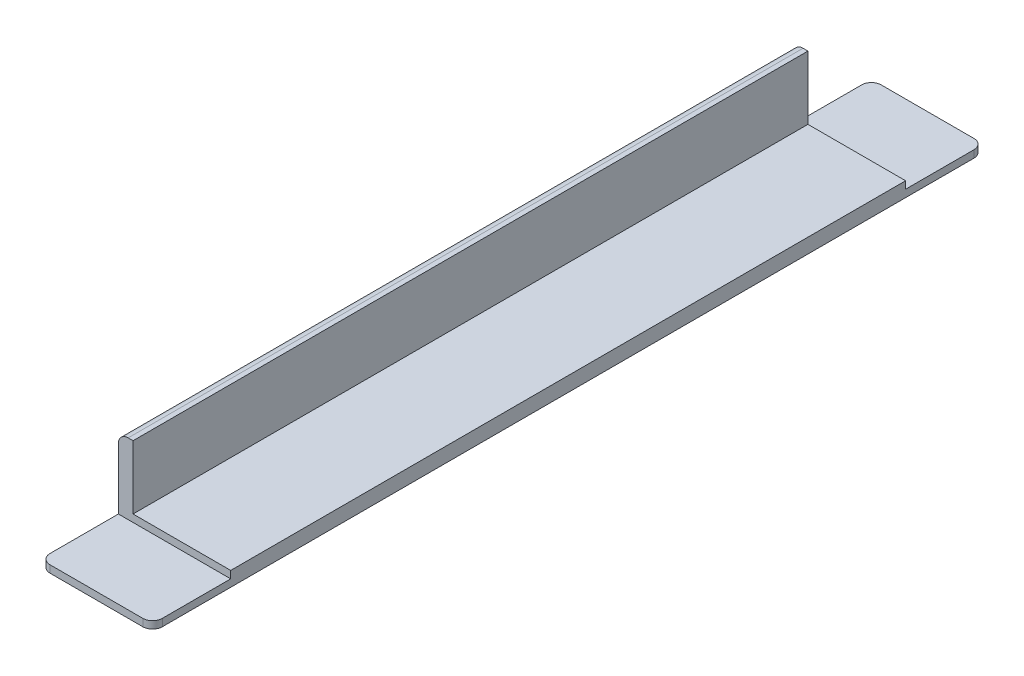
from build123d import *

# Parameters (mm, degrees)
EXTRUDE_1_DEPTH     = 138.2
FILLET_1_R          = 2
SKETCH_2_W          = 23
SKETCH_2_H          = 16
EXTRUDE_2_DEPTH     = 1.5
FILLET_2_R          = 2
SKETCH_3_W          = 0.485163526
SKETCH_3_H          = 0.532163743
SKETCH_3_H_2        = 2.292397661
CUT_EXTRUDE_1_DEPTH = 0.5


with BuildPart() as part:
    # 草图1 → 凸台-拉伸1 (new body)
    with BuildSketch(Plane.XY):
        Polygon((0, 0), (23, 0), (23, 3), (3, 3), (3, 16), (0, 16), align=None)
    extrude(amount=EXTRUDE_1_DEPTH)

    # 圆角1
    fillet_1_edges = [part.edges().sort_by_distance(p)[0] for p in [
        (0, 16, 69.1),
    ]]
    fillet(fillet_1_edges, radius=FILLET_1_R)

    # 草图2 → 凸台-拉伸2 (add)
    with BuildSketch(Plane.XZ):
        with Locations((11.5, 146.2)):
            Rectangle(SKETCH_2_W, SKETCH_2_H)
        with Locations((11.5, -8)):
            Rectangle(SKETCH_2_W, SKETCH_2_H)
    extrude(amount=-EXTRUDE_2_DEPTH)

    # 圆角2
    fillet_2_edges = [part.edges().sort_by_distance(p)[0] for p in [
        (23, 0.75, 154.2),
        (0, 0.75, 154.2),
        (0, 0.75, -16),
        (23, 0.75, -16),
    ]]
    fillet(fillet_2_edges, radius=FILLET_2_R)

    # 草图3 → 切除-拉伸1 (cut)
    # profile 1 of 20: a face of its own
    with BuildSketch(Plane.ZY):
        with BuildLine():
            add(Edge.make_bspline(
                [(38.537246432, 6.44700584), (38.535823224, 6.371398194), (38.533075061, 6.225402541), (38.5111966, 6.014650471), (38.474463625, 5.820794378), (38.423402591, 5.643405011), (38.356486704, 5.4831554), (38.275534237, 5.339056989), (38.17828171, 5.212671907), (38.06649002, 5.10333318), (37.941588688, 5.010500007), (37.807454778, 4.9287665), (37.663116722, 4.859447347), (37.507784665, 4.804608187), (37.343149862, 4.760255348), (37.167814566, 4.729859565), (36.982642821, 4.710284536), (36.85565096, 4.708270515), (36.790657738, 4.707239758)],
                knots=[0, 0, 0, 0, 1.282290039, 2.47605608, 3.589032653, 4.625265017, 5.60120155, 6.528378806, 7.420835006, 8.296783495, 9.172029097, 10.054871634, 10.95783653, 11.882483993, 12.84523908, 13.846605605, 14.897913311, 16, 16, 16, 16], degree=3))
            Line((36.790657738, 4.707239758), (35.965879744, 4.707239758))
            Line((35.965879744, 4.707239758), (35.965879744, 8.207239758))
            Line((35.965879744, 8.207239758), (36.790657738, 8.207239758))
            add(Edge.make_bspline(
                [(36.790657738, 8.207239758), (36.862979417, 8.206302064), (37.003111024, 8.204485173), (37.205715019, 8.184123096), (37.393921994, 8.153026076), (37.567374128, 8.108631296), (37.726261071, 8.051073383), (37.870244503, 7.980558426), (38.000045414, 7.897525901), (38.115077042, 7.800438985), (38.215803627, 7.687941528), (38.302740854, 7.559443809), (38.375140703, 7.414075527), (38.435431316, 7.25283434), (38.48081449, 7.074549821), (38.513878787, 6.880130282), (38.533499213, 6.669015511), (38.535966196, 6.522855374), (38.537246432, 6.44700584)],
                knots=[0, 0, 0, 0, 1.208671633, 2.341940933, 3.400363039, 4.395268851, 5.330777248, 6.220628004, 7.070177666, 7.90046649, 8.729120166, 9.586802476, 10.486089327, 11.437880827, 12.459443466, 13.556765882, 14.732088156, 16, 16, 16, 16], degree=3))
        make_face()
        with BuildLine():
            add(Edge.make_bspline(
                [(37.955050201, 6.44700584), (37.954247041, 6.507679093), (37.952698754, 6.624641695), (37.938970553, 6.793266743), (37.916783421, 6.948120774), (37.885287378, 7.088960573), (37.844709627, 7.215602271), (37.794639572, 7.328151649), (37.735467266, 7.427048661), (37.666432521, 7.512447413), (37.587822333, 7.585251234), (37.500515989, 7.647751851), (37.404462489, 7.701112536), (37.299083503, 7.74435372), (37.184611264, 7.777391902), (37.06137328, 7.801572704), (36.928975192, 7.816101159), (36.837695607, 7.817585806), (36.790657738, 7.818350869)],
                knots=[0, 0, 0, 0, 1.399905721, 2.698662212, 3.901004359, 5.007212274, 6.025105799, 6.964712348, 7.843742593, 8.677021473, 9.489809123, 10.308660959, 11.14915152, 12.019786536, 12.931308064, 13.894202139, 14.914847792, 16, 16, 16, 16], degree=3))
            Line((36.790657738, 7.818350869), (36.523817799, 7.818350869))
            Line((36.523817799, 7.818350869), (36.523817799, 5.096128647))
            Line((36.523817799, 5.096128647), (36.790657738, 5.096128647))
            add(Edge.make_bspline(
                [(36.790657738, 5.096128647), (36.837689681, 5.096965181), (36.928931046, 5.098588047), (37.061335427, 5.112131072), (37.184588427, 5.135552602), (37.298901317, 5.167974894), (37.404196426, 5.209647776), (37.500410724, 5.260601178), (37.58776429, 5.320802031), (37.666076825, 5.391310904), (37.735930104, 5.473834916), (37.794544784, 5.571186905), (37.844910142, 5.682342267), (37.885142264, 5.807864704), (37.916817467, 5.94738368), (37.939069075, 6.101238881), (37.952682388, 6.269371329), (37.954241451, 6.386333046), (37.955050201, 6.44700584)],
                knots=[0, 0, 0, 0, 1.092322287, 2.119091225, 3.087227234, 4.003136754, 4.875110353, 5.712744196, 6.526849681, 7.333109362, 8.153790179, 9.028603962, 9.963721867, 10.982760942, 12.084833146, 13.283506536, 14.590844484, 16, 16, 16, 16], degree=3))
        make_face(mode=Mode.SUBTRACT)
    # profile 2 of 20: a face of its own
    with BuildSketch(Plane.ZY):
        with BuildLine():
            add(Edge.make_bspline(
                [(41.56951847, 5.485017536), (41.564679708, 5.454789435), (41.555160902, 5.39532476), (41.528529811, 5.309500864), (41.493770999, 5.228016566), (41.449422787, 5.150973705), (41.395963561, 5.078554366), (41.333319009, 5.010828657), (41.261635192, 4.947657785), (41.181426784, 4.890137808), (41.095683298, 4.836898645), (41.004473354, 4.79188855), (40.909878862, 4.752729511), (40.81153596, 4.721002291), (40.709095445, 4.69668211), (40.60318743, 4.679522947), (40.493291686, 4.668523765), (40.418797723, 4.667052968), (40.380867831, 4.666304086)],
                knots=[0, 0, 0, 0, 0.931129969, 1.83171744, 2.727856725, 3.623996009, 4.531948698, 5.463078667, 6.427931206, 7.43599385, 8.465297712, 9.497588067, 10.529218693, 11.580376645, 12.640395819, 13.732028972, 14.845223288, 16, 16, 16, 16], degree=3))
            add(Edge.make_bspline(
                [(40.380867831, 4.666304086), (40.333328403, 4.667415722), (40.240302616, 4.669590987), (40.103841355, 4.683916074), (39.973987274, 4.708819346), (39.850657636, 4.744079171), (39.733200784, 4.787519417), (39.622798978, 4.842766862), (39.518586945, 4.907234944), (39.421509795, 4.981294605), (39.333903047, 5.06444042), (39.256398438, 5.154935515), (39.191678153, 5.253717718), (39.138278382, 5.359431257), (39.097300113, 5.472779425), (39.067670624, 5.593170361), (39.050180669, 5.721022098), (39.047855994, 5.808658344), (39.046668135, 5.853438589)],
                knots=[0, 0, 0, 0, 1.134734093, 2.220462808, 3.270903702, 4.286657673, 5.279224475, 6.255698377, 7.228158884, 8.20050715, 9.164739849, 10.106178198, 11.03798362, 11.976693633, 12.926940188, 13.908542119, 14.931309804, 16, 16, 16, 16], degree=3))
            add(Edge.make_bspline(
                [(39.046668135, 5.853438589), (39.047855975, 5.898218854), (39.050180613, 5.985855138), (39.067670834, 6.113706595), (39.09729937, 6.234098534), (39.138281046, 6.347443116), (39.191668362, 6.453169767), (39.256434857, 6.551903324), (39.333651279, 6.642450694), (39.421782818, 6.724789983), (39.518556619, 6.798906079), (39.622784733, 6.863405272), (39.733369686, 6.91840288), (39.850478386, 6.963018845), (39.974013299, 6.99798904), (40.103834063, 7.022980378), (40.240304562, 7.037281048), (40.333329061, 7.039459716), (40.380867831, 7.040573092)],
                knots=[0, 0, 0, 0, 1.068823696, 2.091719143, 3.073443694, 4.023808953, 4.962636228, 5.89455805, 6.836114002, 7.796326289, 8.76879602, 9.741378005, 10.717973887, 11.712806844, 12.728687701, 13.779259814, 14.865124158, 16, 16, 16, 16], degree=3))
            add(Edge.make_bspline(
                [(40.380867831, 7.040573092), (40.42234343, 7.039679191), (40.503729712, 7.037925117), (40.622845083, 7.024773552), (40.736517746, 7.003795447), (40.844512719, 6.973690368), (40.946344097, 6.93361006), (41.043355752, 6.887072688), (41.134031731, 6.830252272), (41.218959882, 6.765499958), (41.296952117, 6.690827564), (41.363652349, 6.603698419), (41.419850157, 6.505597732), (41.466645486, 6.396881965), (41.50147015, 6.276561463), (41.527320742, 6.145463556), (41.542260823, 6.003122346), (41.544236746, 5.904517112), (41.545260294, 5.853438589)],
                knots=[0, 0, 0, 0, 1.04817814, 2.056807499, 3.025136746, 3.967395442, 4.885444636, 5.788100995, 6.683132588, 7.585042941, 8.483895002, 9.403719922, 10.348054461, 11.335159611, 12.388017098, 13.507848719, 14.709040041, 16, 16, 16, 16], degree=3))
            Line((41.545260294, 5.853438589), (39.580348013, 5.853438589))
            add(Edge.make_bspline(
                [(39.580348013, 5.853438589), (39.581098596, 5.81728055), (39.582545485, 5.74757916), (39.592913788, 5.647084073), (39.611141371, 5.55503665), (39.635655477, 5.47087663), (39.66873129, 5.395275831), (39.707670414, 5.327080034), (39.755321801, 5.268052097), (39.809849431, 5.217890262), (39.869227998, 5.174734239), (39.932469458, 5.137763908), (39.998625926, 5.105370908), (40.06867788, 5.080016834), (40.141784074, 5.059131683), (40.218439914, 5.044977607), (40.29855475, 5.036564968), (40.353051232, 5.035346884), (40.380867831, 5.034725138)],
                knots=[0, 0, 0, 0, 1.325909547, 2.55593897, 3.699020134, 4.763208439, 5.763382324, 6.718544283, 7.63460972, 8.53288027, 9.428086675, 10.321228454, 11.21643486, 12.125301335, 13.049392763, 14.001718737, 14.980018769, 16, 16, 16, 16], degree=3))
            add(Edge.make_bspline(
                [(40.380867831, 5.034725138), (40.423422296, 5.035833315), (40.505070162, 5.037959536), (40.621394029, 5.059636274), (40.726077405, 5.094082972), (40.818418124, 5.143549376), (40.897113575, 5.207908176), (40.960536963, 5.287121094), (41.008520422, 5.380537777), (41.026535043, 5.449435629), (41.035838592, 5.485017536)],
                knots=[0, 0, 0, 0, 1.173415052, 2.251393232, 3.252729951, 4.204579296, 5.126178721, 6.038974035, 6.987239213, 8, 8, 8, 8], degree=3))
            Line((41.035838592, 5.485017536), (41.56951847, 5.485017536))
        make_face()
        with BuildLine():
            add(Edge.make_bspline(
                [(40.987322239, 6.180923969), (40.983204614, 6.204017783), (40.975209144, 6.248860603), (40.956554659, 6.312242464), (40.935620515, 6.370899241), (40.909804026, 6.423509022), (40.881034214, 6.471497867), (40.847612973, 6.513019542), (40.810562334, 6.549556487), (40.755590117, 6.590866868), (40.677372829, 6.632272433), (40.573059299, 6.667968524), (40.456525138, 6.689307407), (40.37489612, 6.69148495), (40.332351479, 6.692619875)],
                knots=[0, 0, 0, 0, 0.912248053, 1.77137371, 2.567880399, 3.333178158, 4.048305249, 4.74096846, 5.401616536, 6.068384553, 7.41048694, 8.825547821, 10.345491177, 12, 12, 12, 12], degree=3))
            add(Edge.make_bspline(
                [(40.332351479, 6.692619875), (40.292836741, 6.691413784), (40.215231996, 6.689045088), (40.101914094, 6.667229583), (39.995083165, 6.631111768), (39.910623569, 6.590573229), (39.848138607, 6.549238608), (39.803469455, 6.513436765), (39.762709836, 6.471355311), (39.7243911, 6.424071067), (39.690001637, 6.37089925), (39.657735905, 6.312806885), (39.629025706, 6.249091237), (39.612886638, 6.204038903), (39.60460619, 6.180923969)],
                knots=[0, 0, 0, 0, 1.479561204, 2.905775845, 4.304089696, 5.697264796, 6.401070731, 7.107927311, 7.837748654, 8.591917122, 9.38502374, 10.207214244, 11.080178067, 12, 12, 12, 12], degree=3))
            Line((39.60460619, 6.180923969), (40.987322239, 6.180923969))
        make_face(mode=Mode.SUBTRACT)
    # profile 3 of 20: a face of its own
    with BuildSketch(Plane.ZY):
        with BuildLine():
            add(Edge.make_bspline(
                [(44.577532332, 5.341742682), (44.576804533, 5.315128565), (44.575385932, 5.263253275), (44.560006893, 5.187947968), (44.537325231, 5.117049494), (44.502676251, 5.051755814), (44.460413539, 4.990437591), (44.407084154, 4.935043568), (44.345148228, 4.883732673), (44.273975585, 4.838317509), (44.196155349, 4.797344778), (44.112283252, 4.763073452), (44.024253375, 4.7320978), (43.930789453, 4.708358731), (43.832591932, 4.689334833), (43.729583809, 4.675645435), (43.621461104, 4.668367462), (43.547833205, 4.667002343), (43.510172575, 4.666304086)],
                knots=[0, 0, 0, 0, 0.905022801, 1.764038253, 2.60761387, 3.431246922, 4.271568365, 5.13595473, 6.040527403, 7.004812093, 8.00557445, 9.031583124, 10.087469357, 11.181145959, 12.31187408, 13.492390777, 14.717359254, 16, 16, 16, 16], degree=3))
            add(Edge.make_bspline(
                [(43.510172575, 4.666304086), (43.463157671, 4.666860089), (43.37156257, 4.667943302), (43.238459468, 4.677058703), (43.113436957, 4.692123018), (42.99687679, 4.712953659), (42.888486357, 4.740392234), (42.788382933, 4.773230209), (42.696691064, 4.813084331), (42.613096585, 4.857852761), (42.539211851, 4.909960662), (42.474045445, 4.96643029), (42.419868351, 5.029647567), (42.374051455, 5.0973033), (42.340525685, 5.171717178), (42.314629414, 5.250574704), (42.30058494, 5.335436211), (42.29838856, 5.393750417), (42.29726376, 5.423614027)],
                knots=[0, 0, 0, 0, 1.404840087, 2.73692938, 3.984493996, 5.16643714, 6.272623763, 7.323293492, 8.310850983, 9.257008339, 10.151525766, 11.007508703, 11.826556996, 12.632870738, 13.440315158, 14.257027939, 15.107396936, 16, 16, 16, 16], degree=3))
            Line((42.29726376, 5.423614027), (42.782427286, 5.423614027))
            add(Edge.make_bspline(
                [(42.782427286, 5.423614027), (42.782846369, 5.4038448), (42.783647481, 5.366054281), (42.794268914, 5.311923714), (42.809298408, 5.262404228), (42.832972774, 5.218567374), (42.861445964, 5.179010487), (42.898540522, 5.146543521), (42.940048137, 5.116824033), (43.00697875, 5.087408865), (43.098992811, 5.057995365), (43.218579593, 5.032214866), (43.348829289, 5.017249823), (43.439127025, 5.015278655), (43.485914398, 5.014257302)],
                knots=[0, 0, 0, 0, 0.771180162, 1.474174904, 2.148645932, 2.784654035, 3.412640371, 4.041635023, 4.701714316, 5.399628695, 6.885912405, 8.47205732, 10.172012054, 12, 12, 12, 12], degree=3))
            add(Edge.make_bspline(
                [(43.485914398, 5.014257302), (43.531449217, 5.015415836), (43.616798738, 5.017587367), (43.736110054, 5.03343734), (43.837654209, 5.061540613), (43.921002175, 5.101627642), (43.986306171, 5.151196245), (44.03347746, 5.208377627), (44.063107311, 5.272940439), (44.066435217, 5.318703549), (44.06811063, 5.341742682)],
                knots=[0, 0, 0, 0, 1.475027094, 2.76476027, 3.889266631, 4.874135169, 5.743641568, 6.523554688, 7.256693425, 8, 8, 8, 8], degree=3))
            add(Edge.make_bspline(
                [(44.06811063, 5.341742682), (44.066588872, 5.359174119), (44.063441771, 5.395223526), (44.037871262, 5.447596162), (43.999243941, 5.4992246), (43.955421437, 5.541162499), (43.909196938, 5.574425811), (43.86071139, 5.596669767), (43.801958863, 5.619872026), (43.731520437, 5.6403068), (43.649861285, 5.660201657), (43.556866235, 5.677676771), (43.45258597, 5.695577614), (43.379068484, 5.705133209), (43.340365341, 5.710163735)],
                knots=[0, 0, 0, 0, 0.71124079, 1.470894745, 2.344315819, 3.347016664, 3.941291084, 4.667873981, 5.523019979, 6.528067573, 7.667536758, 8.96435969, 10.401892819, 12, 12, 12, 12], degree=3))
            add(Edge.make_bspline(
                [(43.340365341, 5.710163735), (43.295596206, 5.71565681), (43.209633061, 5.726204301), (43.086377828, 5.746495626), (42.974330167, 5.770662358), (42.872942154, 5.797686284), (42.782508053, 5.828299862), (42.703299625, 5.86339925), (42.63430014, 5.90066065), (42.576362146, 5.943254652), (42.527471854, 5.989251389), (42.485256645, 6.038271888), (42.449204478, 6.090688012), (42.42064238, 6.147250132), (42.397315184, 6.206760101), (42.381838465, 6.270259331), (42.37148263, 6.336997278), (42.370525256, 6.38278186), (42.370038288, 6.406070168)],
                knots=[0, 0, 0, 0, 1.625863408, 3.121890399, 4.501187709, 5.756292836, 6.902808011, 7.938683724, 8.876521529, 9.7237155, 10.522826911, 11.291506406, 12.05199235, 12.809745674, 13.570994995, 14.350873212, 15.161172367, 16, 16, 16, 16], degree=3))
            add(Edge.make_bspline(
                [(42.370038288, 6.406070168), (42.370983073, 6.426344624), (42.372868007, 6.466794063), (42.385950203, 6.526501115), (42.408799894, 6.584028656), (42.438869517, 6.640551619), (42.47947734, 6.694424721), (42.527006762, 6.747922971), (42.584681298, 6.798332522), (42.649539526, 6.847721838), (42.723017896, 6.89345275), (42.805467024, 6.932320342), (42.895162724, 6.966989209), (42.993334747, 6.99364837), (43.099193181, 7.014942671), (43.212921597, 7.029726158), (43.334651606, 7.03898933), (43.418428611, 7.040034039), (43.461656222, 7.040573092)],
                knots=[0, 0, 0, 0, 0.699928621, 1.396423125, 2.097981131, 2.831885793, 3.599700535, 4.42134335, 5.298762704, 6.239281513, 7.234383725, 8.280172304, 9.381996902, 10.550475168, 11.787555133, 13.107827325, 14.507684566, 16, 16, 16, 16], degree=3))
            add(Edge.make_bspline(
                [(43.461656222, 7.040573092), (43.501090581, 7.039958223), (43.577775888, 7.038762531), (43.689667407, 7.030446445), (43.795069114, 7.016381693), (43.893982851, 6.99562779), (43.986739991, 6.970425608), (44.072725512, 6.93814913), (44.152795151, 6.901458349), (44.225395619, 6.858080516), (44.291027883, 6.810552336), (44.347901879, 6.758283892), (44.396312508, 6.702385417), (44.436527395, 6.642893594), (44.466734003, 6.578536513), (44.488935078, 6.510872547), (44.502126049, 6.439175185), (44.503866653, 6.390205749), (44.504757803, 6.365134495)],
                knots=[0, 0, 0, 0, 1.364156675, 2.652782402, 3.879180727, 5.03985611, 6.146987379, 7.200827119, 8.213735713, 9.189720563, 10.121647049, 11.012530915, 11.855461293, 12.674948087, 13.48825705, 14.306530687, 15.132981687, 16, 16, 16, 16], degree=3))
            Line((44.504757803, 6.365134495), (44.019594277, 6.365134495))
            add(Edge.make_bspline(
                [(44.019594277, 6.365134495), (44.019255616, 6.379829689), (44.018596716, 6.408420659), (44.010701738, 6.449405758), (43.998731822, 6.487362256), (43.981102275, 6.521525776), (43.958951365, 6.552542521), (43.931216312, 6.579107286), (43.898725243, 6.602232987), (43.847912175, 6.6284166), (43.776023136, 6.655239588), (43.680314638, 6.676384589), (43.574514334, 6.690393774), (43.500367524, 6.691856303), (43.461656222, 6.692619875)],
                knots=[0, 0, 0, 0, 0.724416251, 1.409424313, 2.052372227, 2.682734859, 3.298994751, 3.925271714, 4.56906601, 5.260966698, 6.741296354, 8.341864132, 10.09012417, 12, 12, 12, 12], degree=3))
            add(Edge.make_bspline(
                [(43.461656222, 6.692619875), (43.436378686, 6.692367175), (43.387548878, 6.691879022), (43.317256286, 6.687094806), (43.252456028, 6.680512203), (43.193267119, 6.671177747), (43.139982284, 6.657155553), (43.092276657, 6.641486401), (43.049614993, 6.62359711), (43.00318479, 6.594872355), (42.955002381, 6.556229676), (42.911447567, 6.503804201), (42.884402557, 6.446081492), (42.881091955, 6.405571678), (42.879459991, 6.385602331)],
                knots=[0, 0, 0, 0, 1.251185924, 2.416974834, 3.48621396, 4.475402834, 5.379544727, 6.210264032, 6.960929726, 7.662458249, 8.906997886, 10.001048311, 11.014615104, 12, 12, 12, 12], degree=3))
            add(Edge.make_bspline(
                [(42.879459991, 6.385602331), (42.880830684, 6.362914937), (42.883509016, 6.318583828), (42.907183518, 6.256039911), (42.946842957, 6.202235981), (42.991640752, 6.16432139), (43.037298483, 6.139306088), (43.080073792, 6.119830538), (43.131830219, 6.104210733), (43.191414408, 6.087978147), (43.259221813, 6.073102531), (43.335582006, 6.059440841), (43.420055188, 6.047486002), (43.479324263, 6.041016405), (43.510172575, 6.037649115)],
                knots=[0, 0, 0, 0, 1.025580986, 2.003982537, 2.97976705, 4.028110589, 4.63319144, 5.335466701, 6.153895959, 7.078904964, 8.13466487, 9.298200537, 10.593769953, 12, 12, 12, 12], degree=3))
            add(Edge.make_bspline(
                [(43.510172575, 6.037649115), (43.560774334, 6.030726178), (43.657690169, 6.017466911), (43.796125317, 5.991975227), (43.921768497, 5.965371278), (44.034778259, 5.935209396), (44.134572179, 5.901465768), (44.221588095, 5.86479453), (44.296868448, 5.82734152), (44.358336281, 5.783417127), (44.410920067, 5.738463476), (44.455135015, 5.689951974), (44.493384612, 5.639545697), (44.524010306, 5.585358264), (44.548587278, 5.528832256), (44.564841404, 5.468771273), (44.576310662, 5.40636524), (44.577120474, 5.363528695), (44.577532332, 5.341742682)],
                knots=[0, 0, 0, 0, 1.74474704, 3.341654925, 4.808121769, 6.131716945, 7.335734793, 8.403633355, 9.357424264, 10.200501587, 10.977751704, 11.717059233, 12.438817566, 13.13486841, 13.838851866, 14.53853412, 15.256720779, 16, 16, 16, 16], degree=3))
        make_face()
    # profile 4 of 20: a face of its own
    with BuildSketch(Plane.ZY):
        with Locations((46.518186437, 7.920690051)):
            Rectangle(SKETCH_3_W, SKETCH_3_H)
    # profile 5 of 20: a face of its own
    with BuildSketch(Plane.ZY):
        with Locations((46.518186437, 5.853438589)):
            Rectangle(SKETCH_3_W, SKETCH_3_H_2)
    # profile 6 of 20: a face of its own
    with BuildSketch(Plane.ZY):
        with BuildLine():
            add(Edge.make_bspline(
                [(51.005949053, 6.651684203), (50.950542698, 6.663867753), (50.842474382, 6.687631377), (50.705842603, 6.702023683), (50.598315479, 6.706105065), (50.516994403, 6.700920414), (50.434013065, 6.69083235), (50.378941253, 6.678442859), (50.350978293, 6.672152039)],
                knots=[0, 0, 0, 0, 1.541856672, 3.007341942, 3.729232138, 4.465727734, 5.220966349, 6, 6, 6, 6], degree=3))
            add(Edge.make_bspline(
                [(50.350978293, 6.672152039), (50.374160153, 6.649991403), (50.421724565, 6.604522333), (50.467438558, 6.53266281), (50.496107803, 6.464424618), (50.51046977, 6.400388676), (50.519359389, 6.325213524), (50.520289348, 6.271165036), (50.520785527, 6.242327478)],
                knots=[0, 0, 0, 0, 1.200955338, 2.464113432, 3.161777216, 3.971733936, 4.917819099, 6, 6, 6, 6], degree=3))
            add(Edge.make_bspline(
                [(50.520785527, 6.242327478), (50.519871264, 6.213980708), (50.518073864, 6.158252246), (50.505077265, 6.076505653), (50.482829016, 5.99879038), (50.4525382, 5.924512602), (50.412582008, 5.854568965), (50.364568742, 5.787974898), (50.307185568, 5.725853202), (50.242196261, 5.667734398), (50.170868986, 5.615190401), (50.0944249, 5.569325011), (50.013875346, 5.530802981), (49.929345908, 5.498489736), (49.840347456, 5.474599909), (49.747348857, 5.457125844), (49.650269757, 5.446346023), (49.584093709, 5.444844859), (49.550458475, 5.444081864)],
                knots=[0, 0, 0, 0, 0.970373, 1.9077093, 2.825150234, 3.732912905, 4.647207361, 5.576523866, 6.53794636, 7.53663933, 8.557569376, 9.566515178, 10.584214193, 11.610992795, 12.660411983, 13.734505198, 14.848519192, 16, 16, 16, 16], degree=3))
            add(Edge.make_bspline(
                [(49.550458475, 5.444081864), (49.53301655, 5.444701632), (49.495545566, 5.446033098), (49.435501209, 5.451247386), (49.368157462, 5.461849915), (49.295456493, 5.473865318), (49.222867493, 5.489308501), (49.155281233, 5.506571196), (49.095289599, 5.525310897), (49.058404588, 5.539663109), (49.041036772, 5.546421045)],
                knots=[0, 0, 0, 0, 0.802509537, 1.724054089, 2.769171959, 3.936348624, 5.112283846, 6.180402174, 7.143217318, 8, 8, 8, 8], degree=3))
            add(Edge.make_bspline(
                [(49.041036772, 5.546421045), (49.020091254, 5.533822988), (48.98346698, 5.511794661), (48.941918669, 5.467874779), (48.922624714, 5.416499613), (48.920745239, 5.381056321), (48.919745891, 5.362210518)],
                knots=[0, 0, 0, 0, 1.250447332, 2.186469029, 3.035714699, 4, 4, 4, 4], degree=3))
            add(Edge.make_bspline(
                [(48.919745891, 5.362210518), (48.921850475, 5.345729433), (48.926211797, 5.311575737), (48.963424775, 5.267687943), (49.018770561, 5.232454923), (49.079370869, 5.210363024), (49.138642777, 5.194956503), (49.194034283, 5.18571532), (49.257126404, 5.176229679), (49.329062524, 5.170138149), (49.408858413, 5.163579235), (49.497371917, 5.160273714), (49.593907129, 5.157902508), (49.661134396, 5.157658652), (49.696007533, 5.157532156)],
                knots=[0, 0, 0, 0, 0.686507151, 1.422646411, 2.319541858, 3.437638634, 4.118767821, 4.897048383, 5.79966601, 6.804159082, 7.934935607, 9.170025639, 10.531993256, 12, 12, 12, 12], degree=3))
            add(Edge.make_bspline(
                [(49.696007533, 5.157532156), (49.752367145, 5.15719827), (49.860341667, 5.156558608), (50.015359808, 5.148926889), (50.156314002, 5.136553009), (50.283289175, 5.11828226), (50.396459701, 5.09630416), (50.495672017, 5.068359623), (50.581269879, 5.035794188), (50.653031498, 4.996278788), (50.713440093, 4.953278782), (50.765416567, 4.908284943), (50.810194045, 4.861355039), (50.845820952, 4.810768812), (50.874731597, 4.758129142), (50.894081282, 4.702210381), (50.907024845, 4.644154734), (50.90828186, 4.604465946), (50.908916348, 4.584432741)],
                knots=[0, 0, 0, 0, 1.81898999, 3.484846074, 5.008216478, 6.384290335, 7.623947343, 8.726358343, 9.707813431, 10.572905661, 11.362707441, 12.096989065, 12.789447227, 13.450298172, 14.088879753, 14.720916975, 15.354373504, 16, 16, 16, 16], degree=3))
            add(Edge.make_bspline(
                [(50.908916348, 4.584432741), (50.907717827, 4.558062799), (50.905362662, 4.506244268), (50.887784206, 4.431174218), (50.857555068, 4.361892947), (50.815987494, 4.297942602), (50.762223555, 4.240038825), (50.696367523, 4.188212822), (50.619636837, 4.141178645), (50.531639393, 4.101127649), (50.436226248, 4.066432569), (50.335822325, 4.03518271), (50.231376917, 4.008513993), (50.122391616, 3.987883422), (50.009784548, 3.969636089), (49.892482254, 3.959308447), (49.771430211, 3.950891166), (49.689201432, 3.950253348), (49.64749118, 3.949929817)],
                knots=[0, 0, 0, 0, 0.81280641, 1.597213831, 2.361547129, 3.133154684, 3.938304976, 4.786534769, 5.710027633, 6.707092792, 7.762326502, 8.839402116, 9.948803833, 11.084280861, 12.259103726, 13.464816371, 14.714037249, 16, 16, 16, 16], degree=3))
            add(Edge.make_bspline(
                [(49.64749118, 3.949929817), (49.594672479, 3.950344611), (49.492525792, 3.951146785), (49.344592324, 3.957891431), (49.207347166, 3.96944135), (49.080432033, 3.983745783), (48.964457768, 4.004677713), (48.858535287, 4.028055191), (48.763714543, 4.057888473), (48.679078123, 4.09083178), (48.60480669, 4.128302867), (48.540136931, 4.168691568), (48.485685156, 4.213278447), (48.440091464, 4.25993747), (48.405627963, 4.311032114), (48.379614847, 4.364618487), (48.365186711, 4.422478574), (48.362943388, 4.462058515), (48.361807836, 4.482093559)],
                knots=[0, 0, 0, 0, 1.669685866, 3.229024467, 4.679827904, 6.023373923, 7.264438528, 8.403829032, 9.449813313, 10.403614423, 11.271712306, 12.076134677, 12.808474427, 13.492146063, 14.130245147, 14.748433623, 15.366467249, 16, 16, 16, 16], degree=3))
            add(Edge.make_bspline(
                [(48.361807836, 4.482093559), (48.363334735, 4.50276276), (48.366477625, 4.545307185), (48.391313749, 4.607948872), (48.430128689, 4.669967538), (48.483608034, 4.730461278), (48.548198278, 4.788930239), (48.623095049, 4.842764235), (48.706819001, 4.891668742), (48.767340073, 4.918560458), (48.798455009, 4.932385957)],
                knots=[0, 0, 0, 0, 0.75110421, 1.546034416, 2.422063539, 3.407302859, 4.475805071, 5.589522888, 6.760731787, 8, 8, 8, 8], degree=3))
            add(Edge.make_bspline(
                [(48.798455009, 4.932385957), (48.775237661, 4.942805964), (48.73030094, 4.962973683), (48.668565758, 4.99960009), (48.614334153, 5.039887688), (48.567224602, 5.083798451), (48.528832556, 5.133705134), (48.50229737, 5.190900694), (48.485844124, 5.254158769), (48.484033266, 5.298428241), (48.483098717, 5.321274846)],
                knots=[0, 0, 0, 0, 1.140885742, 2.20816188, 3.21248222, 4.166611794, 5.089317371, 6.017230327, 6.976731539, 8, 8, 8, 8], degree=3))
            add(Edge.make_bspline(
                [(48.483098717, 5.321274846), (48.484406466, 5.341161307), (48.487026199, 5.380998637), (48.508670908, 5.438258355), (48.543963693, 5.491010051), (48.59247665, 5.53787218), (48.64927607, 5.580649516), (48.710345163, 5.621952087), (48.776715684, 5.658406942), (48.823314465, 5.679160101), (48.846971362, 5.689695899)],
                knots=[0, 0, 0, 0, 0.870109663, 1.743037503, 2.646657052, 3.633988565, 4.684650847, 5.763455701, 6.86456903, 8, 8, 8, 8], degree=3))
            add(Edge.make_bspline(
                [(48.846971362, 5.689695899), (48.827357822, 5.707226096), (48.788229812, 5.742197945), (48.736950222, 5.801913001), (48.690955219, 5.865912069), (48.651709916, 5.934690104), (48.619500692, 6.007408557), (48.596914591, 6.083580305), (48.582681387, 6.162198369), (48.580985725, 6.215482188), (48.580131422, 6.242327478)],
                knots=[0, 0, 0, 0, 0.995927551, 1.986824549, 2.975312631, 3.978944313, 4.982347559, 5.982088738, 6.983342142, 8, 8, 8, 8], degree=3))
            add(Edge.make_bspline(
                [(48.580131422, 6.242327478), (48.581049076, 6.270672734), (48.582853142, 6.326398223), (48.595801393, 6.408166384), (48.61829264, 6.486027187), (48.647963874, 6.56060068), (48.688602691, 6.630189749), (48.736309179, 6.696701064), (48.793742439, 6.758795801), (48.858717603, 6.816922218), (48.930048787, 6.869464111), (49.006491828, 6.915330064), (49.087041664, 6.953851942), (49.171571024, 6.986165228), (49.260569498, 7.010055043), (49.353568091, 7.027529112), (49.450647193, 7.038308932), (49.51682324, 7.039810096), (49.550458475, 7.040573092)],
                knots=[0, 0, 0, 0, 0.970343744, 1.907651783, 2.825065057, 3.740804329, 4.647549644, 5.576838131, 6.538231638, 7.536894497, 8.557793763, 9.566709146, 10.584377477, 11.611125122, 12.660512671, 13.734573501, 14.848553909, 16, 16, 16, 16], degree=3))
            add(Edge.make_bspline(
                [(49.550458475, 7.040573092), (49.585610975, 7.040114679), (49.653538688, 7.039228855), (49.751547556, 7.028974717), (49.842230593, 7.013680323), (49.925618785, 6.990615841), (50.00294691, 6.961557991), (50.075473975, 6.926661623), (50.143335781, 6.884977903), (50.184759281, 6.852233761), (50.205429235, 6.835894729)],
                knots=[0, 0, 0, 0, 1.202802152, 2.32426142, 3.369476868, 4.34734899, 5.280752424, 6.193733414, 7.098689218, 8, 8, 8, 8], degree=3))
            add(Edge.make_bspline(
                [(50.205429235, 6.835894729), (50.23748337, 6.855371412), (50.300362152, 6.893577719), (50.398031149, 6.940984614), (50.49489806, 6.981212241), (50.593040312, 7.010653697), (50.692314682, 7.032549215), (50.794376659, 7.044074907), (50.899399362, 7.048774759), (50.970084955, 7.043333732), (51.005949053, 7.040573092)],
                knots=[0, 0, 0, 0, 1.068031041, 2.095096056, 3.089731504, 4.053052182, 5.010409305, 5.981953454, 6.976093754, 8, 8, 8, 8], degree=3))
            Line((51.005949053, 7.040573092), (51.005949053, 6.651684203))
        make_face()
        with BuildLine():
            add(Edge.make_bspline(
                [(50.035622001, 6.242327478), (50.034290655, 6.274813445), (50.031726902, 6.337371165), (50.008631689, 6.426149075), (49.969993331, 6.504633868), (49.916354968, 6.572587881), (49.846544865, 6.627629991), (49.760829722, 6.666435508), (49.660257501, 6.688929653), (49.58848445, 6.691341865), (49.550458475, 6.692619875)],
                knots=[0, 0, 0, 0, 1.035388428, 1.993831301, 2.902678685, 3.809484398, 4.733940326, 5.711729991, 6.787655006, 8, 8, 8, 8], degree=3))
            add(Edge.make_bspline(
                [(49.550458475, 6.692619875), (49.512432499, 6.691341865), (49.440659449, 6.688929653), (49.340087228, 6.666435508), (49.254372084, 6.627629991), (49.184561981, 6.572587881), (49.130923618, 6.504633868), (49.09228526, 6.426149075), (49.069190047, 6.337371165), (49.066626295, 6.274813445), (49.065294949, 6.242327478)],
                knots=[0, 0, 0, 0, 1.212344994, 2.288270009, 3.266059674, 4.190515602, 5.097321315, 6.006168699, 6.964611572, 8, 8, 8, 8], degree=3))
            add(Edge.make_bspline(
                [(49.065294949, 6.242327478), (49.066626084, 6.209841003), (49.069189431, 6.147282307), (49.092287465, 6.058511185), (49.130915814, 5.980002311), (49.184591341, 5.912137709), (49.254173927, 5.856815328), (49.340412488, 5.819409551), (49.440501778, 5.795374009), (49.512397921, 5.793190821), (49.550458475, 5.79203508)],
                knots=[0, 0, 0, 0, 1.03558553, 1.994210856, 2.903231254, 3.810209591, 4.734841503, 5.709452031, 6.787424218, 8, 8, 8, 8], degree=3))
            add(Edge.make_bspline(
                [(49.550458475, 5.79203508), (49.588519028, 5.793190821), (49.660415172, 5.795374009), (49.760504461, 5.819409551), (49.846743022, 5.856815328), (49.916325608, 5.912137709), (49.970001136, 5.980002311), (50.008629484, 6.058511185), (50.031727518, 6.147282307), (50.034290865, 6.209841003), (50.035622001, 6.242327478)],
                knots=[0, 0, 0, 0, 1.212575782, 2.290547969, 3.265158497, 4.189790409, 5.096768746, 6.005789144, 6.96441447, 8, 8, 8, 8], degree=3))
        make_face(mode=Mode.SUBTRACT)
        with BuildLine():
            add(Edge.make_bspline(
                [(50.448010998, 4.543497068), (50.44658306, 4.557372939), (50.443580361, 4.586551424), (50.420663182, 4.628618578), (50.385306933, 4.669433724), (50.346682294, 4.703768246), (50.30437219, 4.728397386), (50.261052803, 4.744605593), (50.20801543, 4.758812208), (50.144535699, 4.769656168), (50.071199493, 4.778797413), (49.987426867, 4.784372594), (49.893646288, 4.788201346), (49.827663348, 4.788798015), (49.793040238, 4.789111103)],
                knots=[0, 0, 0, 0, 0.654115698, 1.375488837, 2.215371522, 3.206804071, 3.801111348, 4.520006386, 5.386659599, 6.394445158, 7.562279089, 8.880078795, 10.362889324, 12, 12, 12, 12], degree=3))
            add(Edge.make_bspline(
                [(49.793040238, 4.789111103), (49.775351655, 4.789336453), (49.736938113, 4.789825836), (49.674759802, 4.791244257), (49.603498058, 4.794426869), (49.523637355, 4.798904783), (49.436237353, 4.805207717), (49.342198344, 4.811783604), (49.242132252, 4.820193598), (49.173440045, 4.826697716), (49.138069478, 4.830046776)],
                knots=[0, 0, 0, 0, 0.646756231, 1.404532955, 2.273731464, 3.254572799, 4.32877643, 5.477355435, 6.701055424, 8, 8, 8, 8], degree=3))
            add(Edge.make_bspline(
                [(49.138069478, 4.830046776), (49.108015191, 4.820048142), (49.051984058, 4.80140738), (48.977295342, 4.766480846), (48.916963213, 4.729914279), (48.87156035, 4.689724026), (48.839339373, 4.647860338), (48.815982421, 4.606631573), (48.801228751, 4.564943827), (48.799365135, 4.536782339), (48.798455009, 4.523029232)],
                knots=[0, 0, 0, 0, 1.553607012, 2.896437484, 4.039008771, 5.005237994, 5.853793603, 6.620027861, 7.326068806, 8, 8, 8, 8], degree=3))
            add(Edge.make_bspline(
                [(48.798455009, 4.523029232), (48.799024221, 4.512850343), (48.80015769, 4.492581135), (48.809829092, 4.463168926), (48.825304709, 4.435425441), (48.847247999, 4.409387351), (48.874934728, 4.384428857), (48.908169514, 4.359989674), (48.948388073, 4.338491963), (48.994031939, 4.316665581), (49.047922194, 4.297852038), (49.110303319, 4.281451119), (49.181648277, 4.267014146), (49.262211076, 4.25617164), (49.35168378, 4.246877467), (49.450337479, 4.241296241), (49.558008066, 4.237404564), (49.632831134, 4.23679604), (49.671749356, 4.236479524)],
                knots=[0, 0, 0, 0, 0.494225526, 0.984150685, 1.490461749, 2.031970349, 2.632381412, 3.301264706, 4.033267289, 4.847296081, 5.761137072, 6.80492407, 7.983961485, 9.300142887, 10.758354906, 12.35963987, 14.106515144, 16, 16, 16, 16], degree=3))
            add(Edge.make_bspline(
                [(49.671749356, 4.236479524), (49.704858661, 4.236729519), (49.768836257, 4.237212586), (49.861095736, 4.242040407), (49.946355766, 4.248499961), (50.024314609, 4.25817587), (50.09519388, 4.271018007), (50.158904133, 4.286547746), (50.215303986, 4.305684861), (50.264942546, 4.326617904), (50.30781912, 4.35049168), (50.344658985, 4.375334596), (50.3765705, 4.400473371), (50.402466037, 4.426861722), (50.422744622, 4.454680544), (50.437212387, 4.483317218), (50.446158421, 4.513157499), (50.447390181, 4.533329972), (50.448010998, 4.543497068)],
                knots=[0, 0, 0, 0, 1.760791195, 3.402402619, 4.912488501, 6.307748179, 7.578340216, 8.742009871, 9.791761281, 10.742938565, 11.603177184, 12.397137265, 13.10447339, 13.760264691, 14.357079251, 14.928064064, 15.45973525, 16, 16, 16, 16], degree=3))
        make_face(mode=Mode.SUBTRACT)
    # profile 7 of 20: a face of its own
    with BuildSketch(Plane.ZY):
        with BuildLine():
            Line((53.941188386, 4.707239758), (53.45602486, 4.707239758))
            Line((53.45602486, 4.707239758), (53.45602486, 6.180923969))
            add(Edge.make_bspline(
                [(53.45602486, 6.180923969), (53.45560535, 6.200906067), (53.454785004, 6.239980848), (53.447902367, 6.296820541), (53.436552075, 6.350381165), (53.42061567, 6.400685887), (53.400094622, 6.447976084), (53.374911361, 6.492173355), (53.345419737, 6.533329334), (53.299601532, 6.582721218), (53.233556815, 6.636092238), (53.140284697, 6.681330255), (53.035021462, 6.708276859), (52.960919269, 6.711440738), (52.922344981, 6.713087711)],
                knots=[0, 0, 0, 0, 0.845059803, 1.65250549, 2.417739688, 3.158081529, 3.880931281, 4.594233841, 5.306253771, 6.01739055, 7.439704275, 8.869069912, 10.370177782, 12, 12, 12, 12], degree=3))
            add(Edge.make_bspline(
                [(52.922344981, 6.713087711), (52.896265845, 6.712157512), (52.844048842, 6.710295019), (52.766525203, 6.696906704), (52.689965919, 6.675611924), (52.61462919, 6.645195732), (52.541154298, 6.604950412), (52.467768919, 6.558176498), (52.396442691, 6.501261275), (52.326928944, 6.43722503), (52.262278715, 6.366665929), (52.204696062, 6.291478882), (52.157090571, 6.211313128), (52.11697971, 6.127560975), (52.087004754, 6.039124722), (52.064668014, 5.946842705), (52.051795564, 5.850263752), (52.049974946, 5.784491433), (52.049050634, 5.751099407)],
                knots=[0, 0, 0, 0, 0.872987458, 1.747940921, 2.62660953, 3.530064776, 4.461303506, 5.428259611, 6.4405039, 7.512282378, 8.590288404, 9.641189475, 10.677270988, 11.706767097, 12.744988492, 13.797795345, 14.88196013, 16, 16, 16, 16], degree=3))
            Line((52.049050634, 5.751099407), (52.049050634, 4.707239758))
            Line((52.049050634, 4.707239758), (51.563887108, 4.707239758))
            Line((51.563887108, 4.707239758), (51.563887108, 6.999637419))
            Line((51.563887108, 6.999637419), (52.049050634, 6.999637419))
            Line((52.049050634, 6.999637419), (52.049050634, 6.569812858))
            add(Edge.make_bspline(
                [(52.049050634, 6.569812858), (52.081506713, 6.605825767), (52.145129392, 6.676420794), (52.24997497, 6.769739584), (52.35824199, 6.851490241), (52.473168707, 6.920803824), (52.599334387, 6.976118113), (52.741054578, 7.014120879), (52.89912653, 7.036710619), (53.009948198, 7.039246923), (53.067894039, 7.040573092)],
                knots=[0, 0, 0, 0, 0.998552212, 1.957431984, 2.887594526, 3.791491685, 4.717445589, 5.71688022, 6.806214536, 8, 8, 8, 8], degree=3))
            add(Edge.make_bspline(
                [(53.067894039, 7.040573092), (53.10329858, 7.040115128), (53.171729258, 7.039229967), (53.270995559, 7.028911471), (53.36331559, 7.013457488), (53.449137348, 6.991431872), (53.528163746, 6.963085468), (53.599992729, 6.926791328), (53.665577012, 6.885552352), (53.723531537, 6.837014052), (53.774603529, 6.784454316), (53.819162795, 6.728259696), (53.857670967, 6.669267614), (53.887298598, 6.605845017), (53.912633833, 6.540294342), (53.928421767, 6.470815404), (53.939974306, 6.398623016), (53.94077949, 6.349264485), (53.941188386, 6.324198823)],
                knots=[0, 0, 0, 0, 1.331566819, 2.573681737, 3.750631646, 4.850566404, 5.903262406, 6.902435195, 7.872972954, 8.811504036, 9.739331944, 10.625758132, 11.506609418, 12.382572907, 13.254969145, 14.145058687, 15.058008175, 16, 16, 16, 16], degree=3))
            Line((53.941188386, 6.324198823), (53.941188386, 4.707239758))
        make_face()
    # profile 8 of 20: a face of its own
    with BuildSketch(Plane.ZY):
        with BuildLine():
            add(Edge.make_bspline(
                [(57.094751306, 5.485017536), (57.089912543, 5.454789435), (57.080393737, 5.39532476), (57.053762646, 5.309500864), (57.019003834, 5.228016566), (56.974655623, 5.150973705), (56.921196396, 5.078554366), (56.858551844, 5.010828657), (56.786868028, 4.947657785), (56.706659619, 4.890137808), (56.620916133, 4.836898645), (56.529706189, 4.79188855), (56.435111697, 4.752729511), (56.336768795, 4.721002291), (56.234328281, 4.69668211), (56.128420265, 4.679522947), (56.018524521, 4.668523765), (55.944030558, 4.667052968), (55.906100667, 4.666304086)],
                knots=[0, 0, 0, 0, 0.931129969, 1.83171744, 2.727856725, 3.623996009, 4.531948698, 5.463078667, 6.427931206, 7.43599385, 8.465297712, 9.497588067, 10.529218693, 11.580376645, 12.640395819, 13.732028972, 14.845223288, 16, 16, 16, 16], degree=3))
            add(Edge.make_bspline(
                [(55.906100667, 4.666304086), (55.858561239, 4.667415722), (55.765535452, 4.669590987), (55.62907419, 4.683916074), (55.499220109, 4.708819346), (55.375890471, 4.744079171), (55.25843362, 4.787519417), (55.148031813, 4.842766862), (55.04381978, 4.907234944), (54.94674263, 4.981294605), (54.859135882, 5.06444042), (54.781631273, 5.154935515), (54.716910989, 5.253717718), (54.663511217, 5.359431257), (54.622532948, 5.472779425), (54.592903459, 5.593170361), (54.575413504, 5.721022098), (54.573088829, 5.808658344), (54.57190097, 5.853438589)],
                knots=[0, 0, 0, 0, 1.134734093, 2.220462808, 3.270903702, 4.286657673, 5.279224475, 6.255698377, 7.228158884, 8.20050715, 9.164739849, 10.106178198, 11.03798362, 11.976693633, 12.926940188, 13.908542119, 14.931309804, 16, 16, 16, 16], degree=3))
            add(Edge.make_bspline(
                [(54.57190097, 5.853438589), (54.57308881, 5.898218854), (54.575413448, 5.985855138), (54.592903669, 6.113706595), (54.622532205, 6.234098534), (54.663513881, 6.347443116), (54.716901197, 6.453169767), (54.781667692, 6.551903324), (54.858884114, 6.642450694), (54.947015653, 6.724789983), (55.043789454, 6.798906079), (55.148017568, 6.863405272), (55.258602521, 6.91840288), (55.375711222, 6.963018845), (55.499246134, 6.99798904), (55.629066898, 7.022980378), (55.765537397, 7.037281048), (55.858561897, 7.039459716), (55.906100667, 7.040573092)],
                knots=[0, 0, 0, 0, 1.068823696, 2.091719143, 3.073443694, 4.023808953, 4.962636228, 5.89455805, 6.836114002, 7.796326289, 8.76879602, 9.741378005, 10.717973887, 11.712806844, 12.728687701, 13.779259814, 14.865124158, 16, 16, 16, 16], degree=3))
            add(Edge.make_bspline(
                [(55.906100667, 7.040573092), (55.947576265, 7.039679191), (56.028962547, 7.037925117), (56.148077918, 7.024773552), (56.261750581, 7.003795447), (56.369745554, 6.973690368), (56.471576932, 6.93361006), (56.568588588, 6.887072688), (56.659264566, 6.830252272), (56.744192717, 6.765499958), (56.822184952, 6.690827564), (56.888885185, 6.603698419), (56.945082992, 6.505597732), (56.991878322, 6.396881965), (57.026702985, 6.276561463), (57.052553577, 6.145463556), (57.067493658, 6.003122346), (57.069469581, 5.904517112), (57.070493129, 5.853438589)],
                knots=[0, 0, 0, 0, 1.04817814, 2.056807499, 3.025136746, 3.967395442, 4.885444636, 5.788100995, 6.683132588, 7.585042941, 8.483895002, 9.403719922, 10.348054461, 11.335159611, 12.388017098, 13.507848719, 14.709040041, 16, 16, 16, 16], degree=3))
            Line((57.070493129, 5.853438589), (55.105580849, 5.853438589))
            add(Edge.make_bspline(
                [(55.105580849, 5.853438589), (55.106331431, 5.81728055), (55.10777832, 5.74757916), (55.118146623, 5.647084073), (55.136374206, 5.55503665), (55.160888312, 5.47087663), (55.193964125, 5.395275831), (55.232903249, 5.327080034), (55.280554636, 5.268052097), (55.335082266, 5.217890262), (55.394460833, 5.174734239), (55.457702293, 5.137763908), (55.523858761, 5.105370908), (55.593910715, 5.080016834), (55.667016909, 5.059131683), (55.743672749, 5.044977607), (55.823787585, 5.036564968), (55.878284067, 5.035346884), (55.906100667, 5.034725138)],
                knots=[0, 0, 0, 0, 1.325909547, 2.55593897, 3.699020134, 4.763208439, 5.763382324, 6.718544283, 7.63460972, 8.53288027, 9.428086675, 10.321228454, 11.21643486, 12.125301335, 13.049392763, 14.001718737, 14.980018769, 16, 16, 16, 16], degree=3))
            add(Edge.make_bspline(
                [(55.906100667, 5.034725138), (55.948655131, 5.035833315), (56.030302997, 5.037959536), (56.146626864, 5.059636274), (56.25131024, 5.094082972), (56.343650959, 5.143549376), (56.422346411, 5.207908176), (56.485769798, 5.287121094), (56.533753258, 5.380537777), (56.551767878, 5.449435629), (56.561071427, 5.485017536)],
                knots=[0, 0, 0, 0, 1.173415052, 2.251393232, 3.252729951, 4.204579296, 5.126178721, 6.038974035, 6.987239213, 8, 8, 8, 8], degree=3))
            Line((56.561071427, 5.485017536), (57.094751306, 5.485017536))
        make_face()
        with BuildLine():
            add(Edge.make_bspline(
                [(56.512555074, 6.180923969), (56.508437449, 6.204017783), (56.500441979, 6.248860603), (56.481787494, 6.312242464), (56.460853351, 6.370899241), (56.435036861, 6.423509022), (56.406267049, 6.471497867), (56.372845808, 6.513019542), (56.335795169, 6.549556487), (56.280822952, 6.590866868), (56.202605664, 6.632272433), (56.098292134, 6.667968524), (55.981757973, 6.689307407), (55.900128955, 6.69148495), (55.857584314, 6.692619875)],
                knots=[0, 0, 0, 0, 0.912248053, 1.77137371, 2.567880399, 3.333178158, 4.048305249, 4.74096846, 5.401616536, 6.068384553, 7.41048694, 8.825547821, 10.345491177, 12, 12, 12, 12], degree=3))
            add(Edge.make_bspline(
                [(55.857584314, 6.692619875), (55.818069576, 6.691413784), (55.740464831, 6.689045088), (55.62714693, 6.667229583), (55.520316, 6.631111768), (55.435856404, 6.590573229), (55.373371442, 6.549238608), (55.32870229, 6.513436765), (55.287942672, 6.471355311), (55.249623935, 6.424071067), (55.215234473, 6.37089925), (55.18296874, 6.312806885), (55.154258541, 6.249091237), (55.138119473, 6.204038903), (55.129839025, 6.180923969)],
                knots=[0, 0, 0, 0, 1.479561204, 2.905775845, 4.304089696, 5.697264796, 6.401070731, 7.107927311, 7.837748654, 8.591917122, 9.38502374, 10.207214244, 11.080178067, 12, 12, 12, 12], degree=3))
            Line((55.129839025, 6.180923969), (56.512555074, 6.180923969))
        make_face(mode=Mode.SUBTRACT)
    # profile 9 of 20: a face of its own
    with BuildSketch(Plane.ZY):
        with BuildLine():
            Line((60.102765167, 4.707239758), (59.617601641, 4.707239758))
            Line((59.617601641, 4.707239758), (59.617601641, 5.014257302))
            add(Edge.make_bspline(
                [(59.617601641, 5.014257302), (59.593047443, 4.985022426), (59.544979651, 4.927791644), (59.461845049, 4.854823925), (59.373870677, 4.793164047), (59.278039492, 4.745769098), (59.175022169, 4.710110435), (59.063758033, 4.684377269), (58.943333475, 4.669311921), (58.860082554, 4.667328541), (58.817081823, 4.666304086)],
                knots=[0, 0, 0, 0, 1.009108706, 1.97545152, 2.917800698, 3.844935036, 4.794588348, 5.797094018, 6.862155912, 8, 8, 8, 8], degree=3))
            add(Edge.make_bspline(
                [(58.817081823, 4.666304086), (58.777372732, 4.667165637), (58.699229758, 4.668861072), (58.584245061, 4.682621448), (58.473946244, 4.706236618), (58.368106864, 4.738860354), (58.266832481, 4.780706957), (58.17015658, 4.831747746), (58.077879423, 4.891941566), (57.990952869, 4.961358929), (57.910966294, 5.03985363), (57.84130702, 5.128697929), (57.782853447, 5.227187941), (57.734968118, 5.334850049), (57.697869952, 5.451579111), (57.671658854, 5.57730127), (57.655465597, 5.712267854), (57.65363447, 5.805380084), (57.652689361, 5.853438589)],
                knots=[0, 0, 0, 0, 1.013709413, 1.99486478, 2.951552116, 3.890318095, 4.818918565, 5.745364716, 6.677723268, 7.627926882, 8.581454272, 9.532708754, 10.502018753, 11.498435699, 12.534987274, 13.62326076, 14.773281098, 16, 16, 16, 16], degree=3))
            add(Edge.make_bspline(
                [(57.652689361, 5.853438589), (57.653646256, 5.901495526), (57.655505218, 5.99485573), (57.671633182, 6.130337101), (57.698018916, 6.257008236), (57.734782414, 6.374853478), (57.783024149, 6.483620388), (57.841473394, 6.583538746), (57.910883075, 6.674547438), (57.990894968, 6.755307235), (58.077815017, 6.827006874), (58.170100612, 6.88944488), (58.266591711, 6.942890979), (58.367928536, 6.986311898), (58.473926537, 7.019564803), (58.584207684, 7.043928675), (58.699178832, 7.058687652), (58.77736593, 7.060248221), (58.817081823, 7.061040928)],
                knots=[0, 0, 0, 0, 1.218173139, 2.366544738, 3.45350537, 4.495046897, 5.490375608, 6.463958293, 7.423782401, 8.384290572, 9.340000027, 10.276509821, 11.205626349, 12.132730387, 13.066870156, 14.018253017, 14.99335245, 16, 16, 16, 16], degree=3))
            add(Edge.make_bspline(
                [(58.817081823, 7.061040928), (58.860082671, 7.059783434), (58.943389971, 7.05734724), (59.064163092, 7.041248709), (59.175352104, 7.011211093), (59.278377342, 6.97100526), (59.373382147, 6.918617339), (59.462041475, 6.855184399), (59.544534273, 6.779804269), (59.592967804, 6.722013108), (59.617601641, 6.692619875)],
                knots=[0, 0, 0, 0, 1.127873682, 2.185075792, 3.186575251, 4.141561594, 5.078791615, 6.024070681, 6.995020175, 8, 8, 8, 8], degree=3))
            Line((59.617601641, 6.692619875), (59.617601641, 8.207239758))
            Line((59.617601641, 8.207239758), (60.102765167, 8.207239758))
            Line((60.102765167, 8.207239758), (60.102765167, 4.707239758))
        make_face()
        with BuildLine():
            add(Edge.make_bspline(
                [(59.617601641, 5.853438589), (59.617128311, 5.88505545), (59.616205683, 5.946683848), (59.605890901, 6.036359432), (59.590372973, 6.121182331), (59.567461241, 6.200767682), (59.538902793, 6.275676292), (59.502958914, 6.344861682), (59.461010156, 6.409294542), (59.412611215, 6.46792869), (59.359975952, 6.520632933), (59.304190354, 6.566726933), (59.245623112, 6.605343937), (59.184713751, 6.637836517), (59.12061753, 6.661877713), (59.054102932, 6.679485912), (58.984967005, 6.690324132), (58.93790576, 6.691848998), (58.914114528, 6.692619875)],
                knots=[0, 0, 0, 0, 1.237444546, 2.412058657, 3.529829708, 4.61032451, 5.650329254, 6.663730029, 7.657178385, 8.655492879, 9.634997583, 10.569961605, 11.483797059, 12.37781243, 13.267216614, 14.15761092, 15.068602954, 16, 16, 16, 16], degree=3))
            add(Edge.make_bspline(
                [(58.914114528, 6.692619875), (58.88477046, 6.691872202), (58.827652368, 6.690416861), (58.744887095, 6.679744889), (58.667706563, 6.66229698), (58.595923527, 6.638432253), (58.530241033, 6.606056166), (58.469934139, 6.567454457), (58.415412945, 6.521310439), (58.366942759, 6.468169428), (58.324845505, 6.408628871), (58.287116522, 6.344758113), (58.25630465, 6.275133608), (58.230241727, 6.200696266), (58.211034692, 6.120869026), (58.196368282, 6.036334411), (58.188223054, 5.946587656), (58.186998161, 5.88504017), (58.186369239, 5.853438589)],
                knots=[0, 0, 0, 0, 1.114010361, 2.168415974, 3.162282439, 4.115005403, 5.033287067, 5.935488331, 6.827376039, 7.73740015, 8.658684378, 9.591734278, 10.54937244, 11.54462731, 12.582489441, 13.662982671, 14.800057505, 16, 16, 16, 16], degree=3))
            add(Edge.make_bspline(
                [(58.186369239, 5.853438589), (58.186984733, 5.821835489), (58.188178574, 5.760536642), (58.19645891, 5.671060487), (58.210841865, 5.587227522), (58.230247513, 5.508430007), (58.256331734, 5.435526859), (58.286920153, 5.367511471), (58.32494173, 5.305838026), (58.366692813, 5.248444524), (58.416009567, 5.19844384), (58.469718358, 5.15361948), (58.530558943, 5.117580309), (58.596118682, 5.086742226), (58.667726936, 5.063438945), (58.744991243, 5.04711262), (58.827622162, 5.035916814), (58.884763357, 5.035129533), (58.914114528, 5.034725138)],
                knots=[0, 0, 0, 0, 1.213669599, 2.354090202, 3.446944061, 4.477849895, 5.466174186, 6.417105319, 7.335798907, 8.24413183, 9.136302537, 10.025989188, 10.923054883, 11.84348949, 12.804027974, 13.807153955, 14.873621758, 16, 16, 16, 16], degree=3))
            add(Edge.make_bspline(
                [(58.914114528, 5.034725138), (58.937913633, 5.035156359), (58.985002283, 5.036009566), (59.053984543, 5.04736149), (59.120604573, 5.063839173), (59.184516454, 5.087314966), (59.245339875, 5.118252375), (59.30443519, 5.15433496), (59.359412202, 5.199154981), (59.412876363, 5.248661567), (59.460886109, 5.305175231), (59.503165076, 5.367385168), (59.538866827, 5.434978789), (59.567454137, 5.508356898), (59.590588817, 5.586899759), (59.605788298, 5.671039636), (59.616256251, 5.760438366), (59.617144224, 5.821819607), (59.617601641, 5.853438589)],
                knots=[0, 0, 0, 0, 0.941741614, 1.863319724, 2.76155459, 3.65777948, 4.553053645, 5.46127167, 6.394517158, 7.357509275, 8.344394235, 9.324402574, 10.331834667, 11.365285124, 12.439101082, 13.569861061, 14.748175875, 16, 16, 16, 16], degree=3))
        make_face(mode=Mode.SUBTRACT)
    # profile 10 of 20: a face of its own
    with BuildSketch(Plane.ZY):
        with BuildLine():
            add(Edge.make_bspline(
                [(69.611970279, 5.751099407), (69.610903568, 5.703529458), (69.608846752, 5.611805768), (69.590432521, 5.479919308), (69.560717886, 5.35935983), (69.517841254, 5.250279754), (69.463420045, 5.152298605), (69.395705946, 5.066272846), (69.316016361, 4.991719541), (69.223924626, 4.930158584), (69.123408341, 4.877274551), (69.015587993, 4.83219534), (68.901155861, 4.793252967), (68.780068306, 4.761577991), (68.651859813, 4.737438858), (68.517185833, 4.720317825), (68.37548639, 4.70942698), (68.278801704, 4.707980849), (68.22925423, 4.707239758)],
                knots=[0, 0, 0, 0, 1.150967421, 2.219278783, 3.216195936, 4.149859246, 5.048150705, 5.919378958, 6.789253453, 7.678250692, 8.592149981, 9.535064025, 10.50414004, 11.515957393, 12.562026604, 13.659838465, 14.800750155, 16, 16, 16, 16], degree=3))
            Line((68.22925423, 4.707239758), (67.016345414, 4.707239758))
            Line((67.016345414, 4.707239758), (67.016345414, 8.207239758))
            Line((67.016345414, 8.207239758), (68.277770582, 8.207239758))
            add(Edge.make_bspline(
                [(68.277770582, 8.207239758), (68.326830101, 8.206725395), (68.421847829, 8.205729184), (68.559511722, 8.192011255), (68.687999131, 8.172643761), (68.80672387, 8.142549206), (68.916391576, 8.105957424), (69.016743597, 8.060345843), (69.107179639, 8.005696296), (69.187863224, 7.943125133), (69.258769023, 7.875083326), (69.320552125, 7.803399417), (69.373699967, 7.728949566), (69.415813539, 7.650450835), (69.450127791, 7.569473763), (69.473226195, 7.484548168), (69.488314424, 7.396647215), (69.489887516, 7.336787715), (69.490679397, 7.306654963)],
                knots=[0, 0, 0, 0, 1.389193554, 2.690568879, 3.915682932, 5.06676398, 6.155619755, 7.187052631, 8.182690033, 9.142024398, 10.073608908, 10.961858242, 11.819823399, 12.65906926, 13.480635712, 14.305625502, 15.147066589, 16, 16, 16, 16], degree=3))
            add(Edge.make_bspline(
                [(69.490679397, 7.306654963), (69.490200263, 7.277058959), (69.48926779, 7.21946037), (69.479137357, 7.136299457), (69.463507143, 7.058768601), (69.440873452, 6.987594134), (69.411837424, 6.922117033), (69.376327626, 6.862932986), (69.334003631, 6.809646834), (69.269740093, 6.748615714), (69.18330092, 6.684195983), (69.078046694, 6.617319559), (68.9705468, 6.564665467), (68.89642161, 6.540675473), (68.859966813, 6.528877185)],
                knots=[0, 0, 0, 0, 0.97842025, 1.904163377, 2.766342574, 3.591004978, 4.369167686, 5.130267727, 5.867735612, 6.612461008, 8.055075596, 9.425582772, 10.733900621, 12, 12, 12, 12], degree=3))
            add(Edge.make_bspline(
                [(68.859966813, 6.528877185), (68.907634398, 6.517300809), (69.002481769, 6.494266522), (69.137199743, 6.436432734), (69.265069522, 6.364158278), (69.363850105, 6.290376197), (69.43577177, 6.223223513), (69.48342959, 6.168499134), (69.522723165, 6.108798806), (69.555991751, 6.045554849), (69.580634483, 5.977585841), (69.599183796, 5.905816588), (69.609668717, 5.8297412), (69.611192877, 5.777662371), (69.611970279, 5.751099407)],
                knots=[0, 0, 0, 0, 1.498591305, 2.981846991, 4.467297425, 5.985760793, 6.740521116, 7.475133738, 8.199916131, 8.922633731, 9.656513654, 10.406586719, 11.187274755, 12, 12, 12, 12], degree=3))
        make_face()
        with BuildLine():
            add(Edge.make_bspline(
                [(68.932741342, 7.306654963), (68.932121499, 7.328157222), (68.930920651, 7.369814427), (68.922754672, 7.430144031), (68.908185412, 7.48575119), (68.888689933, 7.537201855), (68.862594551, 7.583711484), (68.831059873, 7.626053201), (68.794044532, 7.66409049), (68.736090095, 7.707613401), (68.654713612, 7.75255833), (68.546530538, 7.791477312), (68.427561463, 7.814358888), (68.344835437, 7.816989603), (68.302028758, 7.818350869)],
                knots=[0, 0, 0, 0, 0.84125571, 1.629799079, 2.375534693, 3.086034418, 3.776441328, 4.45463653, 5.146740121, 5.844749619, 7.283181104, 8.765515626, 10.326312314, 12, 12, 12, 12], degree=3))
            Line((68.302028758, 7.818350869), (67.574283469, 7.818350869))
            Line((67.574283469, 7.818350869), (67.574283469, 6.733555548))
            Line((67.574283469, 6.733555548), (68.277770582, 6.733555548))
            add(Edge.make_bspline(
                [(68.277770582, 6.733555548), (68.3208622, 6.735038136), (68.404782512, 6.737925455), (68.525831539, 6.763849102), (68.638128225, 6.804751031), (68.723847558, 6.853174241), (68.784625547, 6.901357392), (68.824924107, 6.942773782), (68.858283954, 6.990267103), (68.885727911, 7.043057127), (68.907095673, 7.101395021), (68.921835919, 7.165054668), (68.931211331, 7.234108745), (68.932218391, 7.281858973), (68.932741342, 7.306654963)],
                knots=[0, 0, 0, 0, 1.567861657, 3.053388221, 4.486058274, 5.908433487, 6.61560495, 7.305558272, 8.005264069, 8.72153997, 9.466964143, 10.261666502, 11.09730905, 12, 12, 12, 12], degree=3))
        make_face(mode=Mode.SUBTRACT)
        with BuildLine():
            add(Edge.make_bspline(
                [(69.029774048, 5.751099407), (69.029179909, 5.777435858), (69.028030412, 5.828389777), (69.015417631, 5.901626168), (68.996166755, 5.96919559), (68.967644678, 6.030282076), (68.932114252, 6.085828666), (68.88694928, 6.133803854), (68.835128061, 6.177030713), (68.754298471, 6.224496508), (68.644489008, 6.272510397), (68.504735289, 6.314404977), (68.357301457, 6.340112524), (68.25639634, 6.343129722), (68.204996053, 6.344666659)],
                knots=[0, 0, 0, 0, 0.825782444, 1.597666052, 2.325424104, 3.024482625, 3.706415027, 4.385574584, 5.084228075, 5.81736823, 7.319209398, 8.834725933, 10.387633835, 12, 12, 12, 12], degree=3))
            Line((68.204996053, 6.344666659), (67.574283469, 6.344666659))
            Line((67.574283469, 6.344666659), (67.574283469, 5.096128647))
            Line((67.574283469, 5.096128647), (68.132221524, 5.096128647))
            add(Edge.make_bspline(
                [(68.132221524, 5.096128647), (68.167608456, 5.096541362), (68.236177881, 5.097341081), (68.335889346, 5.104172555), (68.42893696, 5.115663686), (68.516017119, 5.130178711), (68.596110251, 5.151019652), (68.670526195, 5.174742657), (68.737713119, 5.204621565), (68.799458195, 5.237592375), (68.853927043, 5.277470009), (68.901820051, 5.323978008), (68.94094595, 5.378605754), (68.974375732, 5.43914754), (68.998986446, 5.507561052), (69.017066219, 5.582522997), (69.027628407, 5.664636218), (69.029039612, 5.721503764), (69.029774048, 5.751099407)],
                knots=[0, 0, 0, 0, 1.329104795, 2.57541262, 3.751507257, 4.85005534, 5.888271664, 6.857745527, 7.780027032, 8.64661041, 9.481909892, 10.307445799, 11.142745282, 11.996446227, 12.897382135, 13.864250632, 14.888489489, 16, 16, 16, 16], degree=3))
        make_face(mode=Mode.SUBTRACT)
    # profile 11 of 20: a face of its own
    with BuildSketch(Plane.ZY):
        with BuildLine():
            Line((72.668500493, 6.999637419), (71.552624383, 4.523029232))
            add(Edge.make_bspline(
                [(71.552624383, 4.523029232), (71.535657912, 4.477757324), (71.502942654, 4.390462673), (71.435572617, 4.272565277), (71.356306585, 4.17219744), (71.263786184, 4.090486777), (71.15923194, 4.026487815), (71.042089608, 3.981687827), (70.913016197, 3.954837289), (70.82299148, 3.951604339), (70.776362742, 3.949929817)],
                knots=[0, 0, 0, 0, 1.113038268, 2.146193779, 3.115925527, 4.04856001, 4.976617589, 5.926357458, 6.925946793, 8, 8, 8, 8], degree=3))
            add(Edge.make_bspline(
                [(70.776362742, 3.949929817), (70.736928753, 3.950355949), (70.660004662, 3.951187209), (70.547423459, 3.957964087), (70.439522125, 3.974262554), (70.372754723, 3.999061718), (70.339715568, 4.011333326)],
                knots=[0, 0, 0, 0, 1.06586405, 2.079186684, 3.049505515, 4, 4, 4, 4], degree=3))
            Line((70.339715568, 4.011333326), (70.339715568, 4.420690051))
            add(Edge.make_bspline(
                [(70.339715568, 4.420690051), (70.371843306, 4.408161136), (70.435175758, 4.383463261), (70.530838327, 4.358636908), (70.620191766, 4.342784328), (70.677256273, 4.340070828), (70.703588213, 4.338818706)],
                knots=[0, 0, 0, 0, 1.102568683, 2.173460777, 3.157158748, 4, 4, 4, 4], degree=3))
            add(Edge.make_bspline(
                [(70.703588213, 4.338818706), (70.73343714, 4.339209552), (70.788278659, 4.339927656), (70.863102697, 4.349528733), (70.923129061, 4.364576511), (70.972298852, 4.387347832), (71.010928906, 4.425942011), (71.04662503, 4.477682111), (71.083205444, 4.545327306), (71.104392497, 4.597074143), (71.11597721, 4.625368413)],
                knots=[0, 0, 0, 0, 1.290467383, 2.370979384, 3.253867972, 3.962627068, 4.681760432, 5.582597923, 6.678206589, 8, 8, 8, 8], degree=3))
            Line((71.11597721, 4.625368413), (70.048617452, 6.999637419))
            Line((70.048617452, 6.999637419), (70.582297331, 6.999637419))
            Line((70.582297331, 6.999637419), (71.358558973, 5.198467828))
            Line((71.358558973, 5.198467828), (71.382817149, 5.198467828))
            Line((71.382817149, 5.198467828), (72.134820615, 6.999637419))
            Line((72.134820615, 6.999637419), (72.668500493, 6.999637419))
        make_face()
    # profile 12 of 20: a face of its own
    with BuildSketch(Plane.ZY):
        with BuildLine():
            add(Edge.make_bspline(
                [(78.781560922, 5.873906425), (78.780530919, 5.822827795), (78.778537468, 5.723971071), (78.763601418, 5.581135519), (78.737824375, 5.449254421), (78.702619292, 5.327833346), (78.65634676, 5.217424698), (78.600023418, 5.117573165), (78.532812413, 5.028969424), (78.455516521, 4.95111003), (78.36957174, 4.883751645), (78.276040484, 4.825804099), (78.175811104, 4.776369774), (78.068004182, 4.736338472), (77.953508903, 4.704142487), (77.831314255, 4.682898754), (77.702407606, 4.668688752), (77.613923995, 4.667111218), (77.568652107, 4.666304086)],
                knots=[0, 0, 0, 0, 1.251491889, 2.422116466, 3.513786773, 4.540391907, 5.514413459, 6.440618816, 7.342156724, 8.230953297, 9.121581221, 10.011563216, 10.922598049, 11.855279436, 12.825732301, 13.832559641, 14.891047526, 16, 16, 16, 16], degree=3))
            add(Edge.make_bspline(
                [(77.568652107, 4.666304086), (77.527176725, 4.667205668), (77.445539598, 4.668980277), (77.325925735, 4.682110324), (77.211238584, 4.703107888), (77.102192611, 4.733432249), (76.998110194, 4.772308226), (76.899557431, 4.819918755), (76.806566968, 4.876823526), (76.718253882, 4.940454514), (76.638004242, 5.014883736), (76.568517175, 5.100709786), (76.509831469, 5.197146311), (76.462037847, 5.304187974), (76.424997267, 5.421735296), (76.398935451, 5.549521521), (76.382728306, 5.687763793), (76.380932424, 5.783396358), (76.380001468, 5.832970752)],
                knots=[0, 0, 0, 0, 1.049484004, 2.065728041, 3.041549391, 3.997299203, 4.926162649, 5.849993242, 6.762488062, 7.682148042, 8.600651104, 9.523507286, 10.467828109, 11.449603403, 12.483085993, 13.580515914, 14.745778073, 16, 16, 16, 16], degree=3))
            Line((76.380001468, 5.832970752), (76.380001468, 6.058116951))
            Line((76.380001468, 6.058116951), (76.937939523, 6.058116951))
            Line((76.937939523, 6.058116951), (76.937939523, 5.771567244))
            add(Edge.make_bspline(
                [(76.937939523, 5.771567244), (76.938549129, 5.741984298), (76.939724029, 5.684968771), (76.947915941, 5.602527177), (76.962171395, 5.526947809), (76.981731332, 5.457698792), (77.007542644, 5.395432984), (77.038547071, 5.339297149), (77.075972654, 5.290357289), (77.132656049, 5.235277612), (77.212245581, 5.180251574), (77.315962451, 5.131582925), (77.42777336, 5.10164544), (77.505044164, 5.097990107), (77.544393931, 5.096128647)],
                knots=[0, 0, 0, 0, 1.032975766, 1.990865252, 2.889020579, 3.715627277, 4.498901297, 5.237671927, 5.94889698, 6.641486982, 7.990358788, 9.304882437, 10.627524972, 12, 12, 12, 12], degree=3))
            add(Edge.make_bspline(
                [(77.544393931, 5.096128647), (77.571972821, 5.096341896), (77.625247846, 5.096753836), (77.702305514, 5.106242804), (77.77443886, 5.117008963), (77.840797394, 5.136175013), (77.902719591, 5.157821869), (77.957972266, 5.187804531), (78.009803279, 5.219549534), (78.054717043, 5.259413646), (78.096412215, 5.304272087), (78.12965091, 5.359291606), (78.160136102, 5.421038679), (78.182459518, 5.492075953), (78.202073365, 5.570407708), (78.213976153, 5.657578945), (78.222905017, 5.752681449), (78.223377848, 5.819047767), (78.223622867, 5.853438589)],
                knots=[0, 0, 0, 0, 1.119403051, 2.162386668, 3.151379047, 4.077869831, 4.964605297, 5.809467919, 6.626749434, 7.427355299, 8.241536146, 9.104479673, 10.027380387, 11.033749393, 12.121834257, 13.30508378, 14.603502689, 16, 16, 16, 16], degree=3))
            Line((78.223622867, 5.853438589), (78.223622867, 8.207239758))
            Line((78.223622867, 8.207239758), (78.781560922, 8.207239758))
            Line((78.781560922, 8.207239758), (78.781560922, 5.873906425))
        make_face()
    # profile 13 of 20: a face of its own
    with BuildSketch(Plane.ZY):
        with BuildLine():
            Line((81.959382018, 4.707239758), (81.377185787, 4.707239758))
            add(Edge.make_bspline(
                [(81.377185787, 4.707239758), (81.362012328, 4.722677897), (81.330238643, 4.755005828), (81.300841106, 4.822382094), (81.282889634, 4.903097793), (81.28110995, 4.962078029), (81.280153082, 4.993789466)],
                knots=[0, 0, 0, 0, 0.82756574, 1.73294787, 2.781092004, 4, 4, 4, 4], degree=3))
            add(Edge.make_bspline(
                [(81.280153082, 4.993789466), (81.250914449, 4.967548492), (81.192124353, 4.914785786), (81.092573759, 4.848168892), (80.984118936, 4.791917002), (80.867686254, 4.745973219), (80.745143548, 4.710948064), (80.618998981, 4.684888693), (80.489616335, 4.669510904), (80.402350413, 4.667379133), (80.358342382, 4.666304086)],
                knots=[0, 0, 0, 0, 0.94026994, 1.890600054, 2.859943998, 3.862681373, 4.883815811, 5.909587276, 6.94580902, 8, 8, 8, 8], degree=3))
            add(Edge.make_bspline(
                [(80.358342382, 4.666304086), (80.326729654, 4.666562705), (80.26439846, 4.667072627), (80.173167539, 4.6763911), (80.08508472, 4.687604575), (80.001430974, 4.706279159), (79.920830939, 4.728615383), (79.844955185, 4.757810128), (79.771818125, 4.790299433), (79.703669691, 4.828411308), (79.641279604, 4.871566477), (79.586087234, 4.918982194), (79.540587376, 4.972188156), (79.501414087, 5.028426789), (79.473271735, 5.090647515), (79.451145356, 5.156499626), (79.439488046, 5.227373541), (79.437530076, 5.276007804), (79.436531682, 5.30080701)],
                knots=[0, 0, 0, 0, 1.211982824, 2.389681025, 3.515121333, 4.615914592, 5.674413965, 6.720412696, 7.731191382, 8.742341815, 9.710339505, 10.637688365, 11.524008311, 12.389681533, 13.256927082, 14.133600954, 15.048300309, 16, 16, 16, 16], degree=3))
            add(Edge.make_bspline(
                [(79.436531682, 5.30080701), (79.437209177, 5.325870806), (79.43853051, 5.374753309), (79.450367436, 5.446208085), (79.469183875, 5.513929162), (79.495720517, 5.577952333), (79.530283264, 5.637722842), (79.572610315, 5.693408597), (79.62180745, 5.745909844), (79.679479935, 5.794010951), (79.745005905, 5.837731079), (79.818401591, 5.878403963), (79.900519394, 5.913909138), (79.990099713, 5.94823891), (80.088968583, 5.975017926), (80.195509164, 6.000558473), (80.310435569, 6.021516699), (80.390132761, 6.032170444), (80.431116911, 6.037649115)],
                knots=[0, 0, 0, 0, 0.878359811, 1.713085518, 2.53223945, 3.338592938, 4.136528327, 4.946428165, 5.78640495, 6.654333418, 7.573491504, 8.545179011, 9.59243099, 10.708357688, 11.906039527, 13.180580573, 14.55011821, 16, 16, 16, 16], degree=3))
            add(Edge.make_bspline(
                [(80.431116911, 6.037649115), (80.485989676, 6.044701169), (80.592370964, 6.058372917), (80.746287103, 6.082756525), (80.889768607, 6.108882594), (81.001558372, 6.133762152), (81.083170339, 6.154386534), (81.134803604, 6.172282965), (81.17948124, 6.189450453), (81.214807336, 6.210573057), (81.244390379, 6.230327158), (81.264195133, 6.253640675), (81.278106651, 6.277826962), (81.279481065, 6.295224498), (81.280153082, 6.303730986)],
                knots=[0, 0, 0, 0, 2.153035039, 4.174067781, 6.064369356, 7.827607017, 8.631504408, 9.337460116, 9.954759004, 10.487815547, 10.938269213, 11.328683309, 11.671761153, 12, 12, 12, 12], degree=3))
            add(Edge.make_bspline(
                [(81.280153082, 6.303730986), (81.278786743, 6.324359811), (81.275988965, 6.366600329), (81.25387729, 6.429145655), (81.218760798, 6.490929785), (81.180152997, 6.541672636), (81.139756029, 6.580290639), (81.099505941, 6.604878776), (81.051871649, 6.626163737), (80.99640757, 6.643451853), (80.932782035, 6.655676257), (80.861734187, 6.665853061), (80.782414791, 6.670538932), (80.72701929, 6.67159696), (80.69795685, 6.672152039)],
                knots=[0, 0, 0, 0, 0.955895974, 1.957336037, 3.044153577, 4.247734742, 4.903406093, 5.625764312, 6.423681595, 7.321391218, 8.315108686, 9.42812891, 10.650705462, 12, 12, 12, 12], degree=3))
            add(Edge.make_bspline(
                [(80.69795685, 6.672152039), (80.674446648, 6.671907126), (80.62914802, 6.671435237), (80.563665601, 6.66654753), (80.503131601, 6.660109398), (80.447272299, 6.65051477), (80.396695356, 6.636777959), (80.350912107, 6.620708579), (80.309358315, 6.603184255), (80.262636464, 6.573379733), (80.210332277, 6.531701339), (80.159457547, 6.470772879), (80.11794524, 6.401588751), (80.10044654, 6.350375443), (80.091502443, 6.324198823)],
                knots=[0, 0, 0, 0, 1.113067673, 2.144619538, 3.107914366, 3.995153288, 4.825283364, 5.585929464, 6.293020506, 6.953848052, 8.204077928, 9.443553805, 10.693325512, 12, 12, 12, 12], degree=3))
            Line((80.091502443, 6.324198823), (79.557822564, 6.324198823))
            add(Edge.make_bspline(
                [(79.557822564, 6.324198823), (79.562493476, 6.350880998), (79.571744386, 6.403726012), (79.596596267, 6.479607324), (79.628477595, 6.551734172), (79.668911002, 6.619273639), (79.717178171, 6.682855381), (79.773465607, 6.74196327), (79.837855811, 6.796884231), (79.909647052, 6.847416045), (79.988358094, 6.892717689), (80.073196036, 6.932138368), (80.163215642, 6.966461733), (80.259441702, 6.993554781), (80.361035616, 7.014666589), (80.468402018, 7.029696719), (80.581304427, 7.038920008), (80.658519348, 7.040014222), (80.69795685, 7.040573092)],
                knots=[0, 0, 0, 0, 0.881779826, 1.746396868, 2.594223633, 3.447233491, 4.305316116, 5.190703046, 6.101758681, 7.059054466, 8.047781882, 9.057177534, 10.104846206, 11.183953504, 12.311252143, 13.483984403, 14.714945617, 16, 16, 16, 16], degree=3))
            add(Edge.make_bspline(
                [(80.69795685, 7.040573092), (80.741189447, 7.040113446), (80.824743883, 7.039225103), (80.945960239, 7.028945819), (81.058685877, 7.013483724), (81.163415424, 6.991573186), (81.259782509, 6.963278451), (81.347615665, 6.927145717), (81.427526981, 6.885978297), (81.498771286, 6.837575423), (81.561710734, 6.784038948), (81.616422002, 6.724733994), (81.66282877, 6.66048221), (81.700078805, 6.590382231), (81.73012062, 6.51608941), (81.750105, 6.435950989), (81.763682628, 6.351196587), (81.764764431, 6.292669053), (81.765316608, 6.262795314)],
                knots=[0, 0, 0, 0, 1.385698397, 2.678100667, 3.897121736, 5.03159069, 6.105522665, 7.111974664, 8.072241612, 8.982257721, 9.867116656, 10.715626983, 11.563208623, 12.400506723, 13.254990513, 14.125454458, 15.043190771, 16, 16, 16, 16], degree=3))
            Line((81.765316608, 6.262795314), (81.765316608, 5.13706432))
            add(Edge.make_bspline(
                [(81.765316608, 5.13706432), (81.765877719, 5.117064938), (81.766984623, 5.077612208), (81.776424172, 5.019662696), (81.79135751, 4.964125698), (81.820958602, 4.892238533), (81.874143871, 4.803388756), (81.929934774, 4.740456377), (81.959382018, 4.707239758)],
                knots=[0, 0, 0, 0, 0.743278485, 1.466263569, 2.177490012, 2.877201911, 4.351742066, 6, 6, 6, 6], degree=3))
        make_face()
        with BuildLine():
            Line((81.280153082, 5.4645497), (81.280153082, 5.873906425))
            add(Edge.make_bspline(
                [(81.280153082, 5.873906425), (81.23270202, 5.860819807), (81.140112836, 5.835284461), (81.021122008, 5.805595434), (80.915853424, 5.783894983), (80.814754646, 5.768161897), (80.691345654, 5.748631007), (80.601212955, 5.736954292), (80.552407792, 5.730631571)],
                knots=[0, 0, 0, 0, 1.19302246, 2.327892658, 2.971694893, 3.797323352, 4.80729199, 6, 6, 6, 6], degree=3))
            add(Edge.make_bspline(
                [(80.552407792, 5.730631571), (80.523325057, 5.727018964), (80.467816203, 5.720123749), (80.388575134, 5.707449136), (80.317533317, 5.692299003), (80.254133214, 5.675842956), (80.198670734, 5.657309001), (80.151387716, 5.635874737), (80.11153526, 5.613665846), (80.070200767, 5.581311308), (80.030770039, 5.535897509), (79.995199028, 5.476294947), (79.974015124, 5.410599576), (79.971489941, 5.364885532), (79.970211561, 5.341742682)],
                knots=[0, 0, 0, 0, 1.357355864, 2.590721553, 3.715519573, 4.720493277, 5.623595677, 6.419808662, 7.122435885, 7.731153986, 8.842105171, 9.885924596, 10.929744021, 12, 12, 12, 12], degree=3))
            add(Edge.make_bspline(
                [(79.970211561, 5.341742682), (79.971524868, 5.321862098), (79.974155735, 5.282036539), (79.99571575, 5.224687276), (80.031453383, 5.172149554), (80.079043427, 5.123304246), (80.14162003, 5.082679508), (80.218348032, 5.05409916), (80.308408933, 5.038068229), (80.372678461, 5.035885809), (80.406858735, 5.034725138)],
                knots=[0, 0, 0, 0, 0.799399937, 1.60138903, 2.431575661, 3.345898893, 4.331423255, 5.411059109, 6.623131231, 8, 8, 8, 8], degree=3))
            add(Edge.make_bspline(
                [(80.406858735, 5.034725138), (80.444090454, 5.035830016), (80.520571022, 5.038099631), (80.636954104, 5.059517296), (80.757913397, 5.091460872), (80.881195344, 5.135029407), (81.001061699, 5.192394185), (81.109044018, 5.26776941), (81.204333478, 5.35775434), (81.254735511, 5.428747897), (81.280153082, 5.4645497)],
                knots=[0, 0, 0, 0, 0.882359006, 1.812522161, 2.798187081, 3.848448543, 4.909920325, 5.93908856, 6.960689536, 8, 8, 8, 8], degree=3))
        make_face(mode=Mode.SUBTRACT)
    # profile 14 of 20: a face of its own
    with BuildSketch(Plane.ZY):
        with BuildLine():
            Line((85.234235819, 4.707239758), (84.749072293, 4.707239758))
            Line((84.749072293, 4.707239758), (84.749072293, 6.365134495))
            add(Edge.make_bspline(
                [(84.749072293, 6.365134495), (84.748537308, 6.384879897), (84.747509092, 6.42282966), (84.738394086, 6.477159887), (84.72313937, 6.526138682), (84.702571051, 6.570434206), (84.671366548, 6.608254849), (84.626491468, 6.634403537), (84.570061033, 6.649100159), (84.528823497, 6.650776402), (84.50649053, 6.651684203)],
                knots=[0, 0, 0, 0, 1.094443187, 2.103469948, 3.043066589, 3.932969066, 4.797805128, 5.71583785, 6.762968831, 8, 8, 8, 8], degree=3))
            add(Edge.make_bspline(
                [(84.50649053, 6.651684203), (84.478442606, 6.649731274), (84.421880837, 6.645792976), (84.339687679, 6.614767666), (84.261126025, 6.565711449), (84.188188357, 6.498739064), (84.124409016, 6.417312793), (84.077950853, 6.3213397), (84.050370342, 6.213785774), (84.047215099, 6.138132952), (84.04558518, 6.099052624)],
                knots=[0, 0, 0, 0, 0.84462959, 1.703289796, 2.617477597, 3.626941334, 4.67628392, 5.719847716, 6.822131171, 8, 8, 8, 8], degree=3))
            Line((84.04558518, 6.099052624), (84.04558518, 4.707239758))
            Line((84.04558518, 4.707239758), (83.560421654, 4.707239758))
            Line((83.560421654, 4.707239758), (83.560421654, 6.365134495))
            add(Edge.make_bspline(
                [(83.560421654, 6.365134495), (83.55988667, 6.384879897), (83.558858453, 6.42282966), (83.549743447, 6.477159887), (83.534488731, 6.526138682), (83.513920412, 6.570434206), (83.482715909, 6.608254849), (83.437840829, 6.634403537), (83.381410394, 6.649100159), (83.340172858, 6.650776402), (83.317839891, 6.651684203)],
                knots=[0, 0, 0, 0, 1.094443187, 2.103469948, 3.043066589, 3.932969066, 4.797805128, 5.71583785, 6.762968831, 8, 8, 8, 8], degree=3))
            add(Edge.make_bspline(
                [(83.317839891, 6.651684203), (83.289791967, 6.649731274), (83.233230198, 6.645792976), (83.15103704, 6.614767666), (83.072475386, 6.565711449), (82.999537718, 6.498739064), (82.935758377, 6.417312793), (82.889300214, 6.3213397), (82.861719703, 6.213785774), (82.85856446, 6.138132952), (82.856934541, 6.099052624)],
                knots=[0, 0, 0, 0, 0.84462959, 1.703289796, 2.617477597, 3.626941334, 4.67628392, 5.719847716, 6.822131171, 8, 8, 8, 8], degree=3))
            Line((82.856934541, 6.099052624), (82.856934541, 4.707239758))
            Line((82.856934541, 4.707239758), (82.371771015, 4.707239758))
            Line((82.371771015, 4.707239758), (82.371771015, 6.999637419))
            Line((82.371771015, 6.999637419), (82.856934541, 6.999637419))
            Line((82.856934541, 6.999637419), (82.856934541, 6.692619875))
            add(Edge.make_bspline(
                [(82.856934541, 6.692619875), (82.877576814, 6.718909249), (82.91832473, 6.770804562), (82.989137433, 6.839092036), (83.064776794, 6.899624989), (83.147027919, 6.949552429), (83.233457784, 6.989719841), (83.32321867, 7.020103701), (83.416787832, 7.036699673), (83.480006959, 7.039274112), (83.511905302, 7.040573092)],
                knots=[0, 0, 0, 0, 1.041401506, 2.055730156, 3.060120352, 4.057653504, 5.048470235, 6.027937753, 7.004960686, 8, 8, 8, 8], degree=3))
            add(Edge.make_bspline(
                [(83.511905302, 7.040573092), (83.54304843, 7.039326817), (83.603278466, 7.036916552), (83.690313109, 7.020674919), (83.76906875, 6.990439049), (83.840052579, 6.950279937), (83.902457078, 6.900049661), (83.953382635, 6.839213406), (83.99488137, 6.770004658), (84.012381947, 6.718794755), (84.021327004, 6.692619875)],
                knots=[0, 0, 0, 0, 1.12402142, 2.173829516, 3.178175203, 4.15430423, 5.10711021, 6.051720516, 7.004177322, 8, 8, 8, 8], degree=3))
            add(Edge.make_bspline(
                [(84.021327004, 6.692619875), (84.041772277, 6.718851071), (84.081896528, 6.770330311), (84.150250996, 6.838649092), (84.222005583, 6.899117842), (84.29914224, 6.949489027), (84.380702468, 6.989977236), (84.466792594, 7.020276634), (84.558169408, 7.036773193), (84.620392502, 7.039292006), (84.652039588, 7.040573092)],
                knots=[0, 0, 0, 0, 1.06533426, 2.090739501, 3.091691732, 4.069123981, 5.036465945, 6.004892829, 6.985275014, 8, 8, 8, 8], degree=3))
            add(Edge.make_bspline(
                [(84.652039588, 7.040573092), (84.675549845, 7.040086035), (84.721134874, 7.039141659), (84.787322761, 7.033317764), (84.848829671, 7.022526684), (84.906096849, 7.008527594), (84.958506408, 6.989330092), (85.006829782, 6.966804393), (85.050152108, 6.939263191), (85.089143272, 6.908077497), (85.123551789, 6.872975004), (85.153075254, 6.83412151), (85.178465846, 6.792024405), (85.198954053, 6.74617933), (85.21474739, 6.696822583), (85.226120641, 6.644023625), (85.233026982, 6.587684822), (85.23382506, 6.548859857), (85.234235819, 6.528877185)],
                knots=[0, 0, 0, 0, 1.275708023, 2.473524072, 3.600512497, 4.661257153, 5.66743713, 6.624107633, 7.548400156, 8.445551739, 9.327808737, 10.208039393, 11.087415456, 11.98947725, 12.925992521, 13.894088984, 14.91611675, 16, 16, 16, 16], degree=3))
            Line((85.234235819, 6.528877185), (85.234235819, 4.707239758))
        make_face()
    # profile 15 of 20: a face of its own
    with BuildSketch(Plane.ZY):
        with BuildLine():
            add(Edge.make_bspline(
                [(88.145216976, 5.485017536), (88.140378213, 5.454789435), (88.130859407, 5.39532476), (88.104228317, 5.309500864), (88.069469505, 5.228016566), (88.025121293, 5.150973705), (87.971662067, 5.078554366), (87.909017514, 5.010828657), (87.837333698, 4.947657785), (87.757125289, 4.890137808), (87.671381803, 4.836898645), (87.580171859, 4.79188855), (87.485577367, 4.752729511), (87.387234466, 4.721002291), (87.284793951, 4.69668211), (87.178885936, 4.679522947), (87.068990192, 4.668523765), (86.994496228, 4.667052968), (86.956566337, 4.666304086)],
                knots=[0, 0, 0, 0, 0.931129969, 1.83171744, 2.727856725, 3.623996009, 4.531948698, 5.463078667, 6.427931206, 7.43599385, 8.465297712, 9.497588067, 10.529218693, 11.580376645, 12.640395819, 13.732028972, 14.845223288, 16, 16, 16, 16], degree=3))
            add(Edge.make_bspline(
                [(86.956566337, 4.666304086), (86.909026909, 4.667415722), (86.816001122, 4.669590987), (86.67953986, 4.683916074), (86.549685779, 4.708819346), (86.426356141, 4.744079171), (86.30889929, 4.787519417), (86.198497483, 4.842766862), (86.094285451, 4.907234944), (85.9972083, 4.981294605), (85.909601553, 5.06444042), (85.832096943, 5.154935515), (85.767376659, 5.253717718), (85.713976887, 5.359431257), (85.672998618, 5.472779425), (85.643369129, 5.593170361), (85.625879175, 5.721022098), (85.623554499, 5.808658344), (85.62236664, 5.853438589)],
                knots=[0, 0, 0, 0, 1.134734093, 2.220462808, 3.270903702, 4.286657673, 5.279224475, 6.255698377, 7.228158884, 8.20050715, 9.164739849, 10.106178198, 11.03798362, 11.976693633, 12.926940188, 13.908542119, 14.931309804, 16, 16, 16, 16], degree=3))
            add(Edge.make_bspline(
                [(85.62236664, 5.853438589), (85.62355448, 5.898218854), (85.625879118, 5.985855138), (85.643369339, 6.113706595), (85.672997876, 6.234098534), (85.713979552, 6.347443116), (85.767366867, 6.453169767), (85.832133363, 6.551903324), (85.909349785, 6.642450694), (85.997481323, 6.724789983), (86.094255124, 6.798906079), (86.198483238, 6.863405272), (86.309068191, 6.91840288), (86.426176892, 6.963018845), (86.549711804, 6.99798904), (86.679532568, 7.022980378), (86.816003067, 7.037281048), (86.909027567, 7.039459716), (86.956566337, 7.040573092)],
                knots=[0, 0, 0, 0, 1.068823696, 2.091719143, 3.073443694, 4.023808953, 4.962636228, 5.89455805, 6.836114002, 7.796326289, 8.76879602, 9.741378005, 10.717973887, 11.712806844, 12.728687701, 13.779259814, 14.865124158, 16, 16, 16, 16], degree=3))
            add(Edge.make_bspline(
                [(86.956566337, 7.040573092), (86.998041935, 7.039679191), (87.079428217, 7.037925117), (87.198543588, 7.024773552), (87.312216251, 7.003795447), (87.420211224, 6.973690368), (87.522042603, 6.93361006), (87.619054258, 6.887072688), (87.709730236, 6.830252272), (87.794658388, 6.765499958), (87.872650622, 6.690827564), (87.939350855, 6.603698419), (87.995548663, 6.505597732), (88.042343992, 6.396881965), (88.077168656, 6.276561463), (88.103019248, 6.145463556), (88.117959328, 6.003122346), (88.119935251, 5.904517112), (88.1209588, 5.853438589)],
                knots=[0, 0, 0, 0, 1.04817814, 2.056807499, 3.025136746, 3.967395442, 4.885444636, 5.788100995, 6.683132588, 7.585042941, 8.483895002, 9.403719922, 10.348054461, 11.335159611, 12.388017098, 13.507848719, 14.709040041, 16, 16, 16, 16], degree=3))
            Line((88.1209588, 5.853438589), (86.156046519, 5.853438589))
            add(Edge.make_bspline(
                [(86.156046519, 5.853438589), (86.156797102, 5.81728055), (86.158243991, 5.74757916), (86.168612294, 5.647084073), (86.186839877, 5.55503665), (86.211353983, 5.47087663), (86.244429795, 5.395275831), (86.28336892, 5.327080034), (86.331020306, 5.268052097), (86.385547936, 5.217890262), (86.444926504, 5.174734239), (86.508167963, 5.137763908), (86.574324431, 5.105370908), (86.644376386, 5.080016834), (86.71748258, 5.059131683), (86.794138419, 5.044977607), (86.874253256, 5.036564968), (86.928749738, 5.035346884), (86.956566337, 5.034725138)],
                knots=[0, 0, 0, 0, 1.325909547, 2.55593897, 3.699020134, 4.763208439, 5.763382324, 6.718544283, 7.63460972, 8.53288027, 9.428086675, 10.321228454, 11.21643486, 12.125301335, 13.049392763, 14.001718737, 14.980018769, 16, 16, 16, 16], degree=3))
            add(Edge.make_bspline(
                [(86.956566337, 5.034725138), (86.999120802, 5.035833315), (87.080768667, 5.037959536), (87.197092535, 5.059636274), (87.30177591, 5.094082972), (87.39411663, 5.143549376), (87.472812081, 5.207908176), (87.536235468, 5.287121094), (87.584218928, 5.380537777), (87.602233548, 5.449435629), (87.611537097, 5.485017536)],
                knots=[0, 0, 0, 0, 1.173415052, 2.251393232, 3.252729951, 4.204579296, 5.126178721, 6.038974035, 6.987239213, 8, 8, 8, 8], degree=3))
            Line((87.611537097, 5.485017536), (88.145216976, 5.485017536))
        make_face()
        with BuildLine():
            add(Edge.make_bspline(
                [(87.563020745, 6.180923969), (87.55890312, 6.204017783), (87.550907649, 6.248860603), (87.532253164, 6.312242464), (87.511319021, 6.370899241), (87.485502531, 6.423509022), (87.456732719, 6.471497867), (87.423311478, 6.513019542), (87.386260839, 6.549556487), (87.331288622, 6.590866868), (87.253071334, 6.632272433), (87.148757804, 6.667968524), (87.032223643, 6.689307407), (86.950594626, 6.69148495), (86.908049984, 6.692619875)],
                knots=[0, 0, 0, 0, 0.912248053, 1.77137371, 2.567880399, 3.333178158, 4.048305249, 4.74096846, 5.401616536, 6.068384553, 7.41048694, 8.825547821, 10.345491177, 12, 12, 12, 12], degree=3))
            add(Edge.make_bspline(
                [(86.908049984, 6.692619875), (86.868535247, 6.691413784), (86.790930501, 6.689045088), (86.6776126, 6.667229583), (86.57078167, 6.631111768), (86.486322074, 6.590573229), (86.423837112, 6.549238608), (86.37916796, 6.513436765), (86.338408342, 6.471355311), (86.300089606, 6.424071067), (86.265700143, 6.37089925), (86.233434411, 6.312806885), (86.204724212, 6.249091237), (86.188585143, 6.204038903), (86.180304695, 6.180923969)],
                knots=[0, 0, 0, 0, 1.479561204, 2.905775845, 4.304089696, 5.697264796, 6.401070731, 7.107927311, 7.837748654, 8.591917122, 9.38502374, 10.207214244, 11.080178067, 12, 12, 12, 12], degree=3))
            Line((86.180304695, 6.180923969), (87.563020745, 6.180923969))
        make_face(mode=Mode.SUBTRACT)
    # profile 16 of 20: a face of its own
    with BuildSketch(Plane.ZY):
        with BuildLine():
            add(Edge.make_bspline(
                [(91.153230838, 5.341742682), (91.152503038, 5.315128565), (91.151084438, 5.263253275), (91.135705398, 5.187947968), (91.113023737, 5.117049494), (91.078374757, 5.051755814), (91.036112045, 4.990437591), (90.98278266, 4.935043568), (90.920846733, 4.883732673), (90.849674091, 4.838317509), (90.771853854, 4.797344778), (90.687981757, 4.763073452), (90.599951881, 4.7320978), (90.506487958, 4.708358731), (90.408290438, 4.689334833), (90.305282314, 4.675645435), (90.197159609, 4.668367462), (90.12353171, 4.667002343), (90.08587108, 4.666304086)],
                knots=[0, 0, 0, 0, 0.905022801, 1.764038253, 2.60761387, 3.431246922, 4.271568365, 5.13595473, 6.040527403, 7.004812093, 8.00557445, 9.031583124, 10.087469357, 11.181145959, 12.31187408, 13.492390777, 14.717359254, 16, 16, 16, 16], degree=3))
            add(Edge.make_bspline(
                [(90.08587108, 4.666304086), (90.038856177, 4.666860089), (89.947261075, 4.667943302), (89.814157973, 4.677058703), (89.689135462, 4.692123018), (89.572575296, 4.712953659), (89.464184863, 4.740392234), (89.364081439, 4.773230209), (89.27238957, 4.813084331), (89.18879509, 4.857852761), (89.114910356, 4.909960662), (89.04974395, 4.96643029), (88.995566856, 5.029647567), (88.94974996, 5.0973033), (88.91622419, 5.171717178), (88.89032792, 5.250574704), (88.876283446, 5.335436211), (88.874087065, 5.393750417), (88.872962265, 5.423614027)],
                knots=[0, 0, 0, 0, 1.404840087, 2.73692938, 3.984493996, 5.16643714, 6.272623763, 7.323293492, 8.310850983, 9.257008339, 10.151525766, 11.007508703, 11.826556996, 12.632870738, 13.440315158, 14.257027939, 15.107396936, 16, 16, 16, 16], degree=3))
            Line((88.872962265, 5.423614027), (89.358125791, 5.423614027))
            add(Edge.make_bspline(
                [(89.358125791, 5.423614027), (89.358544874, 5.4038448), (89.359345986, 5.366054281), (89.36996742, 5.311923714), (89.384996913, 5.262404228), (89.40867128, 5.218567374), (89.43714447, 5.179010487), (89.474239027, 5.146543521), (89.515746642, 5.116824033), (89.582677255, 5.087408865), (89.674691317, 5.057995365), (89.794278099, 5.032214866), (89.924527794, 5.017249823), (90.01482553, 5.015278655), (90.061612904, 5.014257302)],
                knots=[0, 0, 0, 0, 0.771180162, 1.474174904, 2.148645932, 2.784654035, 3.412640371, 4.041635023, 4.701714316, 5.399628695, 6.885912405, 8.47205732, 10.172012054, 12, 12, 12, 12], degree=3))
            add(Edge.make_bspline(
                [(90.061612904, 5.014257302), (90.107147722, 5.015415836), (90.192497243, 5.017587367), (90.31180856, 5.03343734), (90.413352715, 5.061540613), (90.496700681, 5.101627642), (90.562004676, 5.151196245), (90.609175965, 5.208377627), (90.638805817, 5.272940439), (90.642133723, 5.318703549), (90.643809135, 5.341742682)],
                knots=[0, 0, 0, 0, 1.475027094, 2.76476027, 3.889266631, 4.874135169, 5.743641568, 6.523554688, 7.256693425, 8, 8, 8, 8], degree=3))
            add(Edge.make_bspline(
                [(90.643809135, 5.341742682), (90.642287377, 5.359174119), (90.639140277, 5.395223526), (90.613569768, 5.447596162), (90.574942447, 5.4992246), (90.531119943, 5.541162499), (90.484895444, 5.574425811), (90.436409895, 5.596669767), (90.377657368, 5.619872026), (90.307218942, 5.6403068), (90.22555979, 5.660201657), (90.132564741, 5.677676771), (90.028284476, 5.695577614), (89.95476699, 5.705133209), (89.916063846, 5.710163735)],
                knots=[0, 0, 0, 0, 0.71124079, 1.470894745, 2.344315819, 3.347016664, 3.941291084, 4.667873981, 5.523019979, 6.528067573, 7.667536758, 8.96435969, 10.401892819, 12, 12, 12, 12], degree=3))
            add(Edge.make_bspline(
                [(89.916063846, 5.710163735), (89.871294711, 5.71565681), (89.785331566, 5.726204301), (89.662076334, 5.746495626), (89.550028672, 5.770662358), (89.44864066, 5.797686284), (89.358206558, 5.828299862), (89.27899813, 5.86339925), (89.209998645, 5.90066065), (89.152060652, 5.943254652), (89.103170359, 5.989251389), (89.060955151, 6.038271888), (89.024902984, 6.090688012), (88.996340885, 6.147250132), (88.973013689, 6.206760101), (88.95753697, 6.270259331), (88.947181136, 6.336997278), (88.946223762, 6.38278186), (88.945736794, 6.406070168)],
                knots=[0, 0, 0, 0, 1.625863408, 3.121890399, 4.501187709, 5.756292836, 6.902808011, 7.938683724, 8.876521529, 9.7237155, 10.522826911, 11.291506406, 12.05199235, 12.809745674, 13.570994995, 14.350873212, 15.161172367, 16, 16, 16, 16], degree=3))
            add(Edge.make_bspline(
                [(88.945736794, 6.406070168), (88.946681579, 6.426344624), (88.948566512, 6.466794063), (88.961648708, 6.526501115), (88.984498399, 6.584028656), (89.014568023, 6.640551619), (89.055175846, 6.694424721), (89.102705268, 6.747922971), (89.160379803, 6.798332522), (89.225238031, 6.847721838), (89.298716402, 6.89345275), (89.381165529, 6.932320342), (89.470861229, 6.966989209), (89.569033253, 6.99364837), (89.674891686, 7.014942671), (89.788620103, 7.029726158), (89.910350112, 7.03898933), (89.994127116, 7.040034039), (90.037354728, 7.040573092)],
                knots=[0, 0, 0, 0, 0.699928621, 1.396423125, 2.097981131, 2.831885793, 3.599700535, 4.42134335, 5.298762704, 6.239281513, 7.234383725, 8.280172304, 9.381996902, 10.550475168, 11.787555133, 13.107827325, 14.507684566, 16, 16, 16, 16], degree=3))
            add(Edge.make_bspline(
                [(90.037354728, 7.040573092), (90.076789087, 7.039958223), (90.153474394, 7.038762531), (90.265365912, 7.030446445), (90.370767619, 7.016381693), (90.469681357, 6.99562779), (90.562438496, 6.970425608), (90.648424018, 6.93814913), (90.728493657, 6.901458349), (90.801094124, 6.858080516), (90.866726389, 6.810552336), (90.923600384, 6.758283892), (90.972011013, 6.702385417), (91.012225901, 6.642893594), (91.042432509, 6.578536513), (91.064633584, 6.510872547), (91.077824555, 6.439175185), (91.079565159, 6.390205749), (91.080456309, 6.365134495)],
                knots=[0, 0, 0, 0, 1.364156675, 2.652782402, 3.879180727, 5.03985611, 6.146987379, 7.200827119, 8.213735713, 9.189720563, 10.121647049, 11.012530915, 11.855461293, 12.674948087, 13.48825705, 14.306530687, 15.132981687, 16, 16, 16, 16], degree=3))
            Line((91.080456309, 6.365134495), (90.595292783, 6.365134495))
            add(Edge.make_bspline(
                [(90.595292783, 6.365134495), (90.594954121, 6.379829689), (90.594295221, 6.408420659), (90.586400243, 6.449405758), (90.574430328, 6.487362256), (90.556800781, 6.521525776), (90.534649871, 6.552542521), (90.506914818, 6.579107286), (90.474423749, 6.602232987), (90.42361068, 6.6284166), (90.351721641, 6.655239588), (90.256013144, 6.676384589), (90.15021284, 6.690393774), (90.076066029, 6.691856303), (90.037354728, 6.692619875)],
                knots=[0, 0, 0, 0, 0.724416251, 1.409424313, 2.052372227, 2.682734859, 3.298994751, 3.925271714, 4.56906601, 5.260966698, 6.741296354, 8.341864132, 10.09012417, 12, 12, 12, 12], degree=3))
            add(Edge.make_bspline(
                [(90.037354728, 6.692619875), (90.012077192, 6.692367175), (89.963247384, 6.691879022), (89.892954791, 6.687094806), (89.828154534, 6.680512203), (89.768965624, 6.671177747), (89.715680789, 6.657155553), (89.667975162, 6.641486401), (89.625313498, 6.62359711), (89.578883295, 6.594872355), (89.530700886, 6.556229676), (89.487146072, 6.503804201), (89.460101062, 6.446081492), (89.45679046, 6.405571678), (89.455158496, 6.385602331)],
                knots=[0, 0, 0, 0, 1.251185924, 2.416974834, 3.48621396, 4.475402834, 5.379544727, 6.210264032, 6.960929726, 7.662458249, 8.906997886, 10.001048311, 11.014615104, 12, 12, 12, 12], degree=3))
            add(Edge.make_bspline(
                [(89.455158496, 6.385602331), (89.45652919, 6.362914937), (89.459207521, 6.318583828), (89.482882023, 6.256039911), (89.522541462, 6.202235981), (89.567339258, 6.16432139), (89.612996988, 6.139306088), (89.655772297, 6.119830538), (89.707528725, 6.104210733), (89.767112913, 6.087978147), (89.834920318, 6.073102531), (89.911280511, 6.059440841), (89.995753694, 6.047486002), (90.055022768, 6.041016405), (90.08587108, 6.037649115)],
                knots=[0, 0, 0, 0, 1.025580986, 2.003982537, 2.97976705, 4.028110589, 4.63319144, 5.335466701, 6.153895959, 7.078904964, 8.13466487, 9.298200537, 10.593769953, 12, 12, 12, 12], degree=3))
            add(Edge.make_bspline(
                [(90.08587108, 6.037649115), (90.136472839, 6.030726178), (90.233388675, 6.017466911), (90.371823823, 5.991975227), (90.497467002, 5.965371278), (90.610476765, 5.935209396), (90.710270684, 5.901465768), (90.797286601, 5.86479453), (90.872566953, 5.82734152), (90.934034787, 5.783417127), (90.986618573, 5.738463476), (91.030833521, 5.689951974), (91.069083117, 5.639545697), (91.099708811, 5.585358264), (91.124285784, 5.528832256), (91.140539909, 5.468771273), (91.152009167, 5.40636524), (91.15281898, 5.363528695), (91.153230838, 5.341742682)],
                knots=[0, 0, 0, 0, 1.74474704, 3.341654925, 4.808121769, 6.131716945, 7.335734793, 8.403633355, 9.357424264, 10.200501587, 10.977751704, 11.717059233, 12.438817566, 13.13486841, 13.838851866, 14.53853412, 15.256720779, 16, 16, 16, 16], degree=3))
        make_face()
    # profile 17 of 20: a face of its own
    with BuildSketch(Plane.ZY):
        Polygon((97.630163911, 8.207239758), (96.490029625, 6.28326315), (96.490029625, 4.707239758), (95.93209157, 4.707239758), (95.93209157, 6.28326315), (94.791957283, 8.207239758), (95.349895338, 8.207239758), (96.198931509, 6.713087711), (96.223189685, 6.713087711), (97.072225856, 8.207239758), align=None)
    # profile 18 of 20: a face of its own
    with BuildSketch(Plane.ZY):
        with BuildLine():
            Line((100.58966142, 4.707239758), (100.007465189, 4.707239758))
            add(Edge.make_bspline(
                [(100.007465189, 4.707239758), (99.99229173, 4.722677897), (99.960518046, 4.755005828), (99.931120509, 4.822382094), (99.913169036, 4.903097793), (99.911389352, 4.962078029), (99.910432484, 4.993789466)],
                knots=[0, 0, 0, 0, 0.82756574, 1.73294787, 2.781092004, 4, 4, 4, 4], degree=3))
            add(Edge.make_bspline(
                [(99.910432484, 4.993789466), (99.881193851, 4.967548492), (99.822403755, 4.914785786), (99.722853161, 4.848168892), (99.614398338, 4.791917002), (99.497965656, 4.745973219), (99.375422951, 4.710948064), (99.249278384, 4.684888693), (99.119895737, 4.669510904), (99.032629815, 4.667379133), (98.988621784, 4.666304086)],
                knots=[0, 0, 0, 0, 0.94026994, 1.890600054, 2.859943998, 3.862681373, 4.883815811, 5.909587276, 6.94580902, 8, 8, 8, 8], degree=3))
            add(Edge.make_bspline(
                [(98.988621784, 4.666304086), (98.957009056, 4.666562705), (98.894677863, 4.667072627), (98.803446941, 4.6763911), (98.715364122, 4.687604575), (98.631710376, 4.706279159), (98.551110342, 4.728615383), (98.475234587, 4.757810128), (98.402097527, 4.790299433), (98.333949093, 4.828411308), (98.271559006, 4.871566477), (98.216366636, 4.918982194), (98.170866778, 4.972188156), (98.131693489, 5.028426789), (98.103551137, 5.090647515), (98.081424758, 5.156499626), (98.069767449, 5.227373541), (98.067809478, 5.276007804), (98.066811085, 5.30080701)],
                knots=[0, 0, 0, 0, 1.211982824, 2.389681025, 3.515121333, 4.615914592, 5.674413965, 6.720412696, 7.731191382, 8.742341815, 9.710339505, 10.637688365, 11.524008311, 12.389681533, 13.256927082, 14.133600954, 15.048300309, 16, 16, 16, 16], degree=3))
            add(Edge.make_bspline(
                [(98.066811085, 5.30080701), (98.067488579, 5.325870806), (98.068809912, 5.374753309), (98.080646839, 5.446208085), (98.099463278, 5.513929162), (98.125999919, 5.577952333), (98.160562666, 5.637722842), (98.202889718, 5.693408597), (98.252086852, 5.745909844), (98.309759337, 5.794010951), (98.375285307, 5.837731079), (98.448680993, 5.878403963), (98.530798796, 5.913909138), (98.620379115, 5.94823891), (98.719247986, 5.975017926), (98.825788566, 6.000558473), (98.940714971, 6.021516699), (99.020412164, 6.032170444), (99.061396313, 6.037649115)],
                knots=[0, 0, 0, 0, 0.878359811, 1.713085518, 2.53223945, 3.338592938, 4.136528327, 4.946428165, 5.78640495, 6.654333418, 7.573491504, 8.545179011, 9.59243099, 10.708357688, 11.906039527, 13.180580573, 14.55011821, 16, 16, 16, 16], degree=3))
            add(Edge.make_bspline(
                [(99.061396313, 6.037649115), (99.116269078, 6.044701169), (99.222650366, 6.058372917), (99.376566505, 6.082756525), (99.52004801, 6.108882594), (99.631837774, 6.133762152), (99.713449741, 6.154386534), (99.765083006, 6.172282965), (99.809760642, 6.189450453), (99.845086738, 6.210573057), (99.874669781, 6.230327158), (99.894474535, 6.253640675), (99.908386053, 6.277826962), (99.909760467, 6.295224498), (99.910432484, 6.303730986)],
                knots=[0, 0, 0, 0, 2.153035039, 4.174067781, 6.064369356, 7.827607017, 8.631504408, 9.337460116, 9.954759004, 10.487815547, 10.938269213, 11.328683309, 11.671761153, 12, 12, 12, 12], degree=3))
            add(Edge.make_bspline(
                [(99.910432484, 6.303730986), (99.909066145, 6.324359811), (99.906268367, 6.366600329), (99.884156692, 6.429145655), (99.8490402, 6.490929785), (99.810432399, 6.541672636), (99.770035431, 6.580290639), (99.729785343, 6.604878776), (99.682151051, 6.626163737), (99.626686972, 6.643451853), (99.563061437, 6.655676257), (99.492013589, 6.665853061), (99.412694193, 6.670538932), (99.357298692, 6.67159696), (99.328236252, 6.672152039)],
                knots=[0, 0, 0, 0, 0.955895974, 1.957336037, 3.044153577, 4.247734742, 4.903406093, 5.625764312, 6.423681595, 7.321391218, 8.315108686, 9.42812891, 10.650705462, 12, 12, 12, 12], degree=3))
            add(Edge.make_bspline(
                [(99.328236252, 6.672152039), (99.30472605, 6.671907126), (99.259427422, 6.671435237), (99.193945003, 6.66654753), (99.133411003, 6.660109398), (99.077551701, 6.65051477), (99.026974758, 6.636777959), (98.981191509, 6.620708579), (98.939637717, 6.603184255), (98.892915866, 6.573379733), (98.84061168, 6.531701339), (98.789736949, 6.470772879), (98.748224643, 6.401588751), (98.730725943, 6.350375443), (98.721781845, 6.324198823)],
                knots=[0, 0, 0, 0, 1.113067673, 2.144619538, 3.107914366, 3.995153288, 4.825283364, 5.585929464, 6.293020506, 6.953848052, 8.204077928, 9.443553805, 10.693325512, 12, 12, 12, 12], degree=3))
            Line((98.721781845, 6.324198823), (98.188101966, 6.324198823))
            add(Edge.make_bspline(
                [(98.188101966, 6.324198823), (98.192772878, 6.350880998), (98.202023788, 6.403726012), (98.226875669, 6.479607324), (98.258756997, 6.551734172), (98.299190404, 6.619273639), (98.347457573, 6.682855381), (98.403745009, 6.74196327), (98.468135214, 6.796884231), (98.539926454, 6.847416045), (98.618637496, 6.892717689), (98.703475438, 6.932138368), (98.793495044, 6.966461733), (98.889721104, 6.993554781), (98.991315018, 7.014666589), (99.09868142, 7.029696719), (99.211583829, 7.038920008), (99.28879875, 7.040014222), (99.328236252, 7.040573092)],
                knots=[0, 0, 0, 0, 0.881779826, 1.746396868, 2.594223633, 3.447233491, 4.305316116, 5.190703046, 6.101758681, 7.059054466, 8.047781882, 9.057177534, 10.104846206, 11.183953504, 12.311252143, 13.483984403, 14.714945617, 16, 16, 16, 16], degree=3))
            add(Edge.make_bspline(
                [(99.328236252, 7.040573092), (99.37146885, 7.040113446), (99.455023285, 7.039225103), (99.576239641, 7.028945819), (99.688965279, 7.013483724), (99.793694826, 6.991573186), (99.890061911, 6.963278451), (99.977895067, 6.927145717), (100.057806384, 6.885978297), (100.129050689, 6.837575423), (100.191990136, 6.784038948), (100.246701405, 6.724733994), (100.293108172, 6.66048221), (100.330358207, 6.590382231), (100.360400022, 6.51608941), (100.380384402, 6.435950989), (100.39396203, 6.351196587), (100.395043834, 6.292669053), (100.39559601, 6.262795314)],
                knots=[0, 0, 0, 0, 1.385698397, 2.678100667, 3.897121736, 5.03159069, 6.105522665, 7.111974664, 8.072241612, 8.982257721, 9.867116656, 10.715626983, 11.563208623, 12.400506723, 13.254990513, 14.125454458, 15.043190771, 16, 16, 16, 16], degree=3))
            Line((100.39559601, 6.262795314), (100.39559601, 5.13706432))
            add(Edge.make_bspline(
                [(100.39559601, 5.13706432), (100.396157122, 5.117064938), (100.397264025, 5.077612208), (100.406703574, 5.019662696), (100.421636912, 4.964125698), (100.451238004, 4.892238533), (100.504423273, 4.803388756), (100.560214176, 4.740456377), (100.58966142, 4.707239758)],
                knots=[0, 0, 0, 0, 0.743278485, 1.466263569, 2.177490012, 2.877201911, 4.351742066, 6, 6, 6, 6], degree=3))
        make_face()
        with BuildLine():
            Line((99.910432484, 5.4645497), (99.910432484, 5.873906425))
            add(Edge.make_bspline(
                [(99.910432484, 5.873906425), (99.862981423, 5.860819807), (99.770392238, 5.835284461), (99.65140141, 5.805595434), (99.546132826, 5.783894983), (99.445034048, 5.768161897), (99.321625056, 5.748631007), (99.231492357, 5.736954292), (99.182687195, 5.730631571)],
                knots=[0, 0, 0, 0, 1.19302246, 2.327892658, 2.971694893, 3.797323352, 4.80729199, 6, 6, 6, 6], degree=3))
            add(Edge.make_bspline(
                [(99.182687195, 5.730631571), (99.153604459, 5.727018964), (99.098095605, 5.720123749), (99.018854536, 5.707449136), (98.947812719, 5.692299003), (98.884412616, 5.675842956), (98.828950137, 5.657309001), (98.781667118, 5.635874737), (98.741814662, 5.613665846), (98.700480169, 5.581311308), (98.661049441, 5.535897509), (98.62547843, 5.476294947), (98.604294526, 5.410599576), (98.601769343, 5.364885532), (98.600490963, 5.341742682)],
                knots=[0, 0, 0, 0, 1.357355864, 2.590721553, 3.715519573, 4.720493277, 5.623595677, 6.419808662, 7.122435885, 7.731153986, 8.842105171, 9.885924596, 10.929744021, 12, 12, 12, 12], degree=3))
            add(Edge.make_bspline(
                [(98.600490963, 5.341742682), (98.60180427, 5.321862098), (98.604435137, 5.282036539), (98.625995152, 5.224687276), (98.661732785, 5.172149554), (98.709322829, 5.123304246), (98.771899433, 5.082679508), (98.848627434, 5.05409916), (98.938688335, 5.038068229), (99.002957864, 5.035885809), (99.037138137, 5.034725138)],
                knots=[0, 0, 0, 0, 0.799399937, 1.60138903, 2.431575661, 3.345898893, 4.331423255, 5.411059109, 6.623131231, 8, 8, 8, 8], degree=3))
            add(Edge.make_bspline(
                [(99.037138137, 5.034725138), (99.074369857, 5.035830016), (99.150850424, 5.038099631), (99.267233506, 5.059517296), (99.3881928, 5.091460872), (99.511474746, 5.135029407), (99.631341102, 5.192394185), (99.73932342, 5.26776941), (99.83461288, 5.35775434), (99.885014914, 5.428747897), (99.910432484, 5.4645497)],
                knots=[0, 0, 0, 0, 0.882359006, 1.812522161, 2.798187081, 3.848448543, 4.909920325, 5.93908856, 6.960689536, 8, 8, 8, 8], degree=3))
        make_face(mode=Mode.SUBTRACT)
    # profile 19 of 20: a face of its own
    with BuildSketch(Plane.ZY):
        with BuildLine():
            add(Edge.make_bspline(
                [(103.573417106, 5.341742682), (103.572689307, 5.315128565), (103.571270706, 5.263253275), (103.555891666, 5.187947968), (103.533210005, 5.117049494), (103.498561025, 5.051755814), (103.456298313, 4.990437591), (103.402968928, 4.935043568), (103.341033001, 4.883732673), (103.269860359, 4.838317509), (103.192040122, 4.797344778), (103.108168026, 4.763073452), (103.020138149, 4.7320978), (102.926674226, 4.708358731), (102.828476706, 4.689334833), (102.725468582, 4.675645435), (102.617345878, 4.668367462), (102.543717978, 4.667002343), (102.506057348, 4.666304086)],
                knots=[0, 0, 0, 0, 0.905022801, 1.764038253, 2.60761387, 3.431246922, 4.271568365, 5.13595473, 6.040527403, 7.004812093, 8.00557445, 9.031583124, 10.087469357, 11.181145959, 12.31187408, 13.492390777, 14.717359254, 16, 16, 16, 16], degree=3))
            add(Edge.make_bspline(
                [(102.506057348, 4.666304086), (102.459042445, 4.666860089), (102.367447343, 4.667943302), (102.234344241, 4.677058703), (102.10932173, 4.692123018), (101.992761564, 4.712953659), (101.884371131, 4.740392234), (101.784267707, 4.773230209), (101.692575838, 4.813084331), (101.608981358, 4.857852761), (101.535096624, 4.909960662), (101.469930219, 4.96643029), (101.415753124, 5.029647567), (101.369936228, 5.0973033), (101.336410458, 5.171717178), (101.310514188, 5.250574704), (101.296469714, 5.335436211), (101.294273334, 5.393750417), (101.293148533, 5.423614027)],
                knots=[0, 0, 0, 0, 1.404840087, 2.73692938, 3.984493996, 5.16643714, 6.272623763, 7.323293492, 8.310850983, 9.257008339, 10.151525766, 11.007508703, 11.826556996, 12.632870738, 13.440315158, 14.257027939, 15.107396936, 16, 16, 16, 16], degree=3))
            Line((101.293148533, 5.423614027), (101.778312059, 5.423614027))
            add(Edge.make_bspline(
                [(101.778312059, 5.423614027), (101.778731142, 5.4038448), (101.779532255, 5.366054281), (101.790153688, 5.311923714), (101.805183181, 5.262404228), (101.828857548, 5.218567374), (101.857330738, 5.179010487), (101.894425295, 5.146543521), (101.93593291, 5.116824033), (102.002863523, 5.087408865), (102.094877585, 5.057995365), (102.214464367, 5.032214866), (102.344714062, 5.017249823), (102.435011798, 5.015278655), (102.481799172, 5.014257302)],
                knots=[0, 0, 0, 0, 0.771180162, 1.474174904, 2.148645932, 2.784654035, 3.412640371, 4.041635023, 4.701714316, 5.399628695, 6.885912405, 8.47205732, 10.172012054, 12, 12, 12, 12], degree=3))
            add(Edge.make_bspline(
                [(102.481799172, 5.014257302), (102.52733399, 5.015415836), (102.612683511, 5.017587367), (102.731994828, 5.03343734), (102.833538983, 5.061540613), (102.916886949, 5.101627642), (102.982190945, 5.151196245), (103.029362234, 5.208377627), (103.058992085, 5.272940439), (103.062319991, 5.318703549), (103.063995403, 5.341742682)],
                knots=[0, 0, 0, 0, 1.475027094, 2.76476027, 3.889266631, 4.874135169, 5.743641568, 6.523554688, 7.256693425, 8, 8, 8, 8], degree=3))
            add(Edge.make_bspline(
                [(103.063995403, 5.341742682), (103.062473645, 5.359174119), (103.059326545, 5.395223526), (103.033756036, 5.447596162), (102.995128715, 5.4992246), (102.951306211, 5.541162499), (102.905081712, 5.574425811), (102.856596164, 5.596669767), (102.797843636, 5.619872026), (102.727405211, 5.6403068), (102.645746059, 5.660201657), (102.552751009, 5.677676771), (102.448470744, 5.695577614), (102.374953258, 5.705133209), (102.336250114, 5.710163735)],
                knots=[0, 0, 0, 0, 0.71124079, 1.470894745, 2.344315819, 3.347016664, 3.941291084, 4.667873981, 5.523019979, 6.528067573, 7.667536758, 8.96435969, 10.401892819, 12, 12, 12, 12], degree=3))
            add(Edge.make_bspline(
                [(102.336250114, 5.710163735), (102.291480979, 5.71565681), (102.205517834, 5.726204301), (102.082262602, 5.746495626), (101.970214941, 5.770662358), (101.868826928, 5.797686284), (101.778392827, 5.828299862), (101.699184398, 5.86339925), (101.630184913, 5.90066065), (101.57224692, 5.943254652), (101.523356628, 5.989251389), (101.481141419, 6.038271888), (101.445089252, 6.090688012), (101.416527153, 6.147250132), (101.393199957, 6.206760101), (101.377723239, 6.270259331), (101.367367404, 6.336997278), (101.36641003, 6.38278186), (101.365923062, 6.406070168)],
                knots=[0, 0, 0, 0, 1.625863408, 3.121890399, 4.501187709, 5.756292836, 6.902808011, 7.938683724, 8.876521529, 9.7237155, 10.522826911, 11.291506406, 12.05199235, 12.809745674, 13.570994995, 14.350873212, 15.161172367, 16, 16, 16, 16], degree=3))
            add(Edge.make_bspline(
                [(101.365923062, 6.406070168), (101.366867847, 6.426344624), (101.36875278, 6.466794063), (101.381834976, 6.526501115), (101.404684667, 6.584028656), (101.434754291, 6.640551619), (101.475362114, 6.694424721), (101.522891536, 6.747922971), (101.580566071, 6.798332522), (101.645424299, 6.847721838), (101.71890267, 6.89345275), (101.801351798, 6.932320342), (101.891047497, 6.966989209), (101.989219521, 6.99364837), (102.095077954, 7.014942671), (102.208806371, 7.029726158), (102.33053638, 7.03898933), (102.414313384, 7.040034039), (102.457540996, 7.040573092)],
                knots=[0, 0, 0, 0, 0.699928621, 1.396423125, 2.097981131, 2.831885793, 3.599700535, 4.42134335, 5.298762704, 6.239281513, 7.234383725, 8.280172304, 9.381996902, 10.550475168, 11.787555133, 13.107827325, 14.507684566, 16, 16, 16, 16], degree=3))
            add(Edge.make_bspline(
                [(102.457540996, 7.040573092), (102.496975355, 7.039958223), (102.573660662, 7.038762531), (102.685552181, 7.030446445), (102.790953888, 7.016381693), (102.889867625, 6.99562779), (102.982624765, 6.970425608), (103.068610286, 6.93814913), (103.148679925, 6.901458349), (103.221280392, 6.858080516), (103.286912657, 6.810552336), (103.343786653, 6.758283892), (103.392197281, 6.702385417), (103.432412169, 6.642893594), (103.462618777, 6.578536513), (103.484819852, 6.510872547), (103.498010823, 6.439175185), (103.499751427, 6.390205749), (103.500642577, 6.365134495)],
                knots=[0, 0, 0, 0, 1.364156675, 2.652782402, 3.879180727, 5.03985611, 6.146987379, 7.200827119, 8.213735713, 9.189720563, 10.121647049, 11.012530915, 11.855461293, 12.674948087, 13.48825705, 14.306530687, 15.132981687, 16, 16, 16, 16], degree=3))
            Line((103.500642577, 6.365134495), (103.015479051, 6.365134495))
            add(Edge.make_bspline(
                [(103.015479051, 6.365134495), (103.015140389, 6.379829689), (103.01448149, 6.408420659), (103.006586511, 6.449405758), (102.994616596, 6.487362256), (102.976987049, 6.521525776), (102.954836139, 6.552542521), (102.927101086, 6.579107286), (102.894610017, 6.602232987), (102.843796949, 6.6284166), (102.77190791, 6.655239588), (102.676199412, 6.676384589), (102.570399108, 6.690393774), (102.496252297, 6.691856303), (102.457540996, 6.692619875)],
                knots=[0, 0, 0, 0, 0.724416251, 1.409424313, 2.052372227, 2.682734859, 3.298994751, 3.925271714, 4.56906601, 5.260966698, 6.741296354, 8.341864132, 10.09012417, 12, 12, 12, 12], degree=3))
            add(Edge.make_bspline(
                [(102.457540996, 6.692619875), (102.43226346, 6.692367175), (102.383433652, 6.691879022), (102.313141059, 6.687094806), (102.248340802, 6.680512203), (102.189151892, 6.671177747), (102.135867058, 6.657155553), (102.088161431, 6.641486401), (102.045499766, 6.62359711), (101.999069563, 6.594872355), (101.950887155, 6.556229676), (101.90733234, 6.503804201), (101.88028733, 6.446081492), (101.876976728, 6.405571678), (101.875344764, 6.385602331)],
                knots=[0, 0, 0, 0, 1.251185924, 2.416974834, 3.48621396, 4.475402834, 5.379544727, 6.210264032, 6.960929726, 7.662458249, 8.906997886, 10.001048311, 11.014615104, 12, 12, 12, 12], degree=3))
            add(Edge.make_bspline(
                [(101.875344764, 6.385602331), (101.876715458, 6.362914937), (101.87939379, 6.318583828), (101.903068291, 6.256039911), (101.94272773, 6.202235981), (101.987525526, 6.16432139), (102.033183257, 6.139306088), (102.075958565, 6.119830538), (102.127714993, 6.104210733), (102.187299181, 6.087978147), (102.255106586, 6.073102531), (102.331466779, 6.059440841), (102.415939962, 6.047486002), (102.475209036, 6.041016405), (102.506057348, 6.037649115)],
                knots=[0, 0, 0, 0, 1.025580986, 2.003982537, 2.97976705, 4.028110589, 4.63319144, 5.335466701, 6.153895959, 7.078904964, 8.13466487, 9.298200537, 10.593769953, 12, 12, 12, 12], degree=3))
            add(Edge.make_bspline(
                [(102.506057348, 6.037649115), (102.556659107, 6.030726178), (102.653574943, 6.017466911), (102.792010091, 5.991975227), (102.91765327, 5.965371278), (103.030663033, 5.935209396), (103.130456952, 5.901465768), (103.217472869, 5.86479453), (103.292753221, 5.82734152), (103.354221055, 5.783417127), (103.406804841, 5.738463476), (103.451019789, 5.689951974), (103.489269385, 5.639545697), (103.51989508, 5.585358264), (103.544472052, 5.528832256), (103.560726178, 5.468771273), (103.572195435, 5.40636524), (103.573005248, 5.363528695), (103.573417106, 5.341742682)],
                knots=[0, 0, 0, 0, 1.74474704, 3.341654925, 4.808121769, 6.131716945, 7.335734793, 8.403633355, 9.357424264, 10.200501587, 10.977751704, 11.717059233, 12.438817566, 13.13486841, 13.838851866, 14.53853412, 15.256720779, 16, 16, 16, 16], degree=3))
        make_face()
    # profile 20 of 20: a face of its own
    with BuildSketch(Plane.ZY):
        with BuildLine():
            Line((106.921045436, 4.707239758), (106.338849205, 4.707239758))
            Line((106.338849205, 4.707239758), (105.465554858, 6.221859641))
            Line((105.465554858, 6.221859641), (104.834842274, 6.221859641))
            Line((104.834842274, 6.221859641), (104.834842274, 4.707239758))
            Line((104.834842274, 4.707239758), (104.276904219, 4.707239758))
            Line((104.276904219, 4.707239758), (104.276904219, 8.207239758))
            Line((104.276904219, 8.207239758), (105.489813034, 8.207239758))
            add(Edge.make_bspline(
                [(105.489813034, 8.207239758), (105.537335546, 8.206462597), (105.629975778, 8.204947602), (105.76575208, 8.194580332), (105.894329367, 8.175565283), (106.016315061, 8.149605108), (106.131824529, 8.117867007), (106.239887114, 8.076087473), (106.341771613, 8.028908507), (106.436209668, 7.973432595), (106.5221692, 7.910538896), (106.59717842, 7.837230286), (106.660172892, 7.754428313), (106.711417103, 7.661835816), (106.751803992, 7.560798799), (106.779355032, 7.449844071), (106.797354295, 7.330240847), (106.798939237, 7.247089887), (106.799754554, 7.204315782)],
                knots=[0, 0, 0, 0, 1.215518262, 2.369527416, 3.480095147, 4.537303756, 5.558270229, 6.540171901, 7.497189444, 8.42719965, 9.337231716, 10.214757506, 11.100244596, 11.988534203, 12.913883803, 13.874821779, 14.90677633, 16, 16, 16, 16], degree=3))
            add(Edge.make_bspline(
                [(106.799754554, 7.204315782), (106.799062454, 7.171179322), (106.79771094, 7.106471385), (106.786167073, 7.012341241), (106.767461874, 6.92393487), (106.740738329, 6.841386401), (106.706765814, 6.764440051), (106.664556916, 6.693380755), (106.615326706, 6.627681387), (106.557959466, 6.569139106), (106.496686567, 6.515387399), (106.432291222, 6.467158738), (106.365811714, 6.423407064), (106.297108343, 6.385022822), (106.226111201, 6.351141121), (106.152725176, 6.323438019), (106.077016616, 6.300257431), (106.025352475, 6.28896952), (105.999234736, 6.28326315)],
                knots=[0, 0, 0, 0, 1.190988919, 2.325729366, 3.403774804, 4.435181458, 5.439710536, 6.421300617, 7.400659953, 8.383720393, 9.362278789, 10.328914226, 11.273831537, 12.221539823, 13.156225845, 14.099394603, 15.039188238, 16, 16, 16, 16], degree=3))
            Line((105.999234736, 6.28326315), (106.921045436, 4.707239758))
        make_face()
        with BuildLine():
            add(Edge.make_bspline(
                [(106.241816499, 7.204315782), (106.24133954, 7.227604518), (106.240406966, 7.273139788), (106.230035717, 7.339385431), (106.214475711, 7.40209184), (106.191596646, 7.460577534), (106.162337296, 7.515284934), (106.126816243, 7.566044954), (106.08426811, 7.612817734), (106.035775055, 7.656142156), (105.979851315, 7.695389474), (105.915687157, 7.728417796), (105.843817012, 7.756639212), (105.763925073, 7.778794043), (105.676367016, 7.79720435), (105.580826774, 7.809649435), (105.477307615, 7.817357421), (105.405682326, 7.818011516), (105.368522152, 7.818350869)],
                knots=[0, 0, 0, 0, 0.921064911, 1.800910931, 2.6475541, 3.474107407, 4.279573572, 5.098160647, 5.919675613, 6.776887553, 7.667582329, 8.616045475, 9.626458221, 10.718706842, 11.893733148, 13.165419955, 14.529381355, 16, 16, 16, 16], degree=3))
            Line((105.368522152, 7.818350869), (104.834842274, 7.818350869))
            Line((104.834842274, 7.818350869), (104.834842274, 6.61074853))
            Line((104.834842274, 6.61074853), (105.51407121, 6.61074853))
            add(Edge.make_bspline(
                [(105.51407121, 6.61074853), (105.561195842, 6.612235946), (105.653112377, 6.615137148), (105.786130463, 6.641079077), (105.910537493, 6.681721826), (106.006069812, 6.730460415), (106.075699612, 6.777944937), (106.120040983, 6.82152431), (106.158605826, 6.869999754), (106.188684199, 6.925732888), (106.213522416, 6.986555414), (106.229369149, 7.054099352), (106.240707007, 7.127114729), (106.241438111, 7.177986635), (106.241816499, 7.204315782)],
                knots=[0, 0, 0, 0, 1.587771533, 3.096946394, 4.552106153, 5.988910748, 6.69819588, 7.385222547, 8.077304046, 8.779179147, 9.513415525, 10.286388052, 11.113106969, 12, 12, 12, 12], degree=3))
        make_face(mode=Mode.SUBTRACT)
    extrude(amount=-CUT_EXTRUDE_1_DEPTH, mode=Mode.SUBTRACT)


solid = part.part
